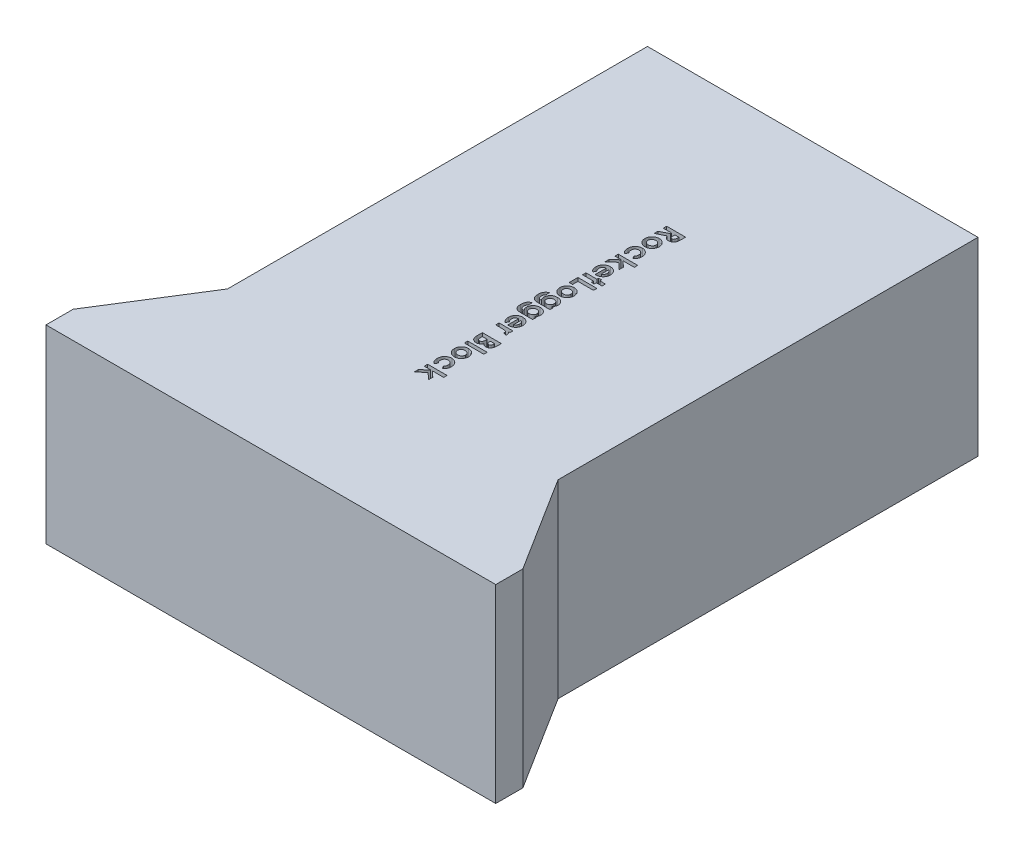
from build123d import *

# Parameters (mm, degrees)
BOSS_EXTRUDE1_DEPTH = 35
SKETCH2_W           = 3.58974359
SKETCH2_H           = 0.628205129
CUT_EXTRUDE1_DEPTH  = 5


with BuildPart() as part:
    # Sketch1 → Boss-Extrude1 (new body)
    with BuildSketch(Plane(origin=(0, 0, 0), x_dir=(1, 0, 0), z_dir=(0, 1, 0))):
        Polygon((-41.5, 0), (41.5, 0), (41.5, 5), (30.5, 22.5), (30.5, 100), (-30.5, 100), (-30.5, 22.5), (-41.5, 5), align=None)
    extrude(amount=BOSS_EXTRUDE1_DEPTH)

    # Sketch2 → Cut-Extrude1 (cut)
    # profile 1 of 17: a face of its own
    with BuildSketch(Plane(origin=(0, 35, 0), x_dir=(1, 0, 0), z_dir=(0, 1, 0))):
        with BuildLine():
            Line((3.5, 73.041666667), (3.5, 72.309695513))
            add(Edge.make_bspline(
                [(3.5, 72.309695513), (3.499828795, 72.261312365), (3.49949952, 72.168257943), (3.49428145, 72.034079788), (3.487053229, 71.910814317), (3.475887663, 71.798067928), (3.461449259, 71.696286705), (3.44393254, 71.605255076), (3.424143413, 71.52492018), (3.39988877, 71.454197037), (3.371956861, 71.390548982), (3.340429771, 71.331386173), (3.304116196, 71.275665734), (3.264487542, 71.222364929), (3.220124454, 71.17243515), (3.171386442, 71.12601474), (3.118624808, 71.082506812), (3.062156822, 71.041853789), (3.002061312, 71.005677243), (2.939191587, 70.973626607), (2.873377757, 70.947294), (2.804996593, 70.925368199), (2.733965865, 70.908486668), (2.660331689, 70.897024731), (2.584062765, 70.888549679), (2.532243077, 70.888066823), (2.505809295, 70.887820513)],
                knots=[0, 0, 0, 0, 1.749037589, 3.363891962, 4.853828513, 6.212420965, 7.458679178, 8.568887289, 9.562757098, 10.447168552, 11.268163578, 12.073310924, 12.867792413, 13.67045336, 14.472446998, 15.279188696, 16.101356728, 16.943088626, 17.792208908, 18.634830833, 19.491484118, 20.351879174, 21.228996054, 22.12769993, 23.044919519, 24, 24, 24, 24], degree=3))
            add(Edge.make_bspline(
                [(2.505809295, 70.887820513), (2.478219036, 70.888464475), (2.424119568, 70.889727167), (2.344651861, 70.896528716), (2.268622717, 70.90895981), (2.196254741, 70.927788511), (2.126647229, 70.949429656), (2.061084482, 70.978206829), (1.998612986, 71.010684712), (1.940116424, 71.049257745), (1.884295469, 71.091589765), (1.833288831, 71.140821013), (1.784355094, 71.193762061), (1.740559303, 71.253388919), (1.698940145, 71.317073178), (1.661222103, 71.386080179), (1.626457035, 71.459959557), (1.607069631, 71.511900418), (1.597155449, 71.538461538)],
                knots=[0, 0, 0, 0, 1.099860209, 2.156625411, 3.176576793, 4.16617041, 5.135385252, 6.078461593, 7.016046972, 7.938469504, 8.868247731, 9.803980173, 10.76021508, 11.73834243, 12.748633912, 13.790971185, 14.870363756, 16, 16, 16, 16], degree=3))
            Line((1.597155449, 71.538461538), (0, 70.730769231))
            Line((0, 70.730769231), (0, 71.429086538))
            Line((0, 71.429086538), (1.525641026, 72.200320513))
            Line((1.525641026, 72.200320513), (1.525641026, 72.413461538))
            Line((1.525641026, 72.413461538), (0, 72.413461538))
            Line((0, 72.413461538), (0, 73.041666667))
            Line((0, 73.041666667), (3.5, 73.041666667))
        make_face()
        with BuildLine():
            Line((2.153846154, 72.413461538), (2.153846154, 72.168770032))
            add(Edge.make_bspline(
                [(2.153846154, 72.168770032), (2.154183078, 72.138854457), (2.154828216, 72.081572558), (2.15782074, 71.999193739), (2.165030877, 71.924373861), (2.174141568, 71.856792771), (2.184658195, 71.796106707), (2.199739292, 71.742868763), (2.215869631, 71.696221175), (2.236011539, 71.656833708), (2.25851446, 71.623044634), (2.285206251, 71.594722488), (2.314445692, 71.569771696), (2.348073129, 71.550200079), (2.384710851, 71.534387474), (2.425048162, 71.524581007), (2.468354708, 71.516800504), (2.498523537, 71.516290853), (2.514222756, 71.516025641)],
                knots=[0, 0, 0, 0, 1.688935225, 3.233948049, 4.651771667, 5.929878493, 7.083962697, 8.124219224, 9.050753627, 9.864999381, 10.615157594, 11.334035464, 12.05533055, 12.777108108, 13.522027315, 14.29964284, 15.115170198, 16, 16, 16, 16], degree=3))
            add(Edge.make_bspline(
                [(2.514222756, 71.516025641), (2.53277191, 71.51673817), (2.569208284, 71.518137802), (2.621663167, 71.532027264), (2.670216539, 71.554134562), (2.714635437, 71.584443887), (2.75361627, 71.622591035), (2.787698432, 71.666293915), (2.815276822, 71.716197241), (2.832939391, 71.762732906), (2.843795948, 71.805364976), (2.8515027, 71.843714002), (2.857478213, 71.888243058), (2.86326295, 71.938703678), (2.867244729, 71.995312865), (2.870062043, 72.057966067), (2.871231041, 72.126698696), (2.871601517, 72.174612625), (2.871794872, 72.199619391)],
                knots=[0, 0, 0, 0, 1.020213939, 2.004021227, 2.966357326, 3.948562114, 4.950324333, 5.960000531, 6.991850424, 8.080015304, 8.69218159, 9.414443227, 10.233931419, 11.166782034, 12.212677862, 13.359889063, 14.622099264, 16, 16, 16, 16], degree=3))
            Line((2.871794872, 72.199619391), (2.871794872, 72.413461538))
            Line((2.871794872, 72.413461538), (2.153846154, 72.413461538))
        make_face(mode=Mode.SUBTRACT)
    # profile 2 of 17: a face of its own
    with BuildSketch(Plane(origin=(0, 35, 0), x_dir=(1, 0, 0), z_dir=(0, 1, 0))):
        with BuildLine():
            add(Edge.make_bspline(
                [(2.602564103, 69.0859375), (2.602036039, 69.056237031), (2.600990234, 68.997416646), (2.592270108, 68.909813542), (2.578080404, 68.823731985), (2.559528301, 68.738505804), (2.534007893, 68.654978813), (2.502911323, 68.572974412), (2.467417172, 68.491808115), (2.425149036, 68.413310801), (2.379254227, 68.336964729), (2.328950548, 68.264560266), (2.27355537, 68.197347467), (2.215913225, 68.132767871), (2.152057288, 68.074674207), (2.086496875, 68.018221644), (2.015265956, 67.968310954), (1.941218623, 67.921923148), (1.864350594, 67.880782163), (1.785518705, 67.844720793), (1.705074857, 67.814736589), (1.6230636, 67.790151485), (1.539846867, 67.770082985), (1.45465435, 67.757350928), (1.368315589, 67.748319024), (1.310186874, 67.747304935), (1.280949519, 67.746794872)],
                knots=[0, 0, 0, 0, 1.022204334, 2.024427765, 3.026941746, 4.024310199, 5.024497409, 6.030105378, 7.042160749, 8.071431822, 9.096544462, 10.107544126, 11.102638816, 12.093496961, 13.083897781, 14.071714019, 15.069569032, 16.074114518, 17.078305592, 18.068346939, 19.056064894, 20.030822231, 21.014304768, 21.999661014, 22.993877291, 24, 24, 24, 24], degree=3))
            add(Edge.make_bspline(
                [(1.280949519, 67.746794872), (1.251483609, 67.747332774), (1.192898699, 67.748402245), (1.105749868, 67.757028251), (1.020149054, 67.77129859), (0.935591969, 67.789776379), (0.8531606, 67.81547102), (0.771639876, 67.845492465), (0.692140957, 67.882344969), (0.613796583, 67.923088128), (0.538912191, 67.969700294), (0.46725794, 68.019680307), (0.400713659, 68.075072116), (0.337215623, 68.13282704), (0.278911053, 68.195684526), (0.224853238, 68.262641251), (0.174381296, 68.333117556), (0.128679395, 68.407620239), (0.088522765, 68.485195047), (0.052318285, 68.564533694), (0.022175471, 68.646100108), (-0.002405164, 68.729725483), (-0.021437335, 68.815460536), (-0.034366115, 68.903115986), (-0.043357932, 68.992503054), (-0.044363925, 69.052728541), (-0.044871795, 69.083133013)],
                knots=[0, 0, 0, 0, 1.012026251, 2.012137606, 3.004615893, 3.992048833, 4.982446996, 5.968083444, 6.973977695, 7.990229942, 8.999482246, 10.001782172, 10.988562221, 11.971415814, 12.948383116, 13.930088534, 14.925840678, 15.924049238, 16.929462851, 17.924729459, 18.917889337, 19.913673841, 20.916777188, 21.931792057, 22.95587778, 24, 24, 24, 24], degree=3))
            add(Edge.make_bspline(
                [(-0.044871795, 69.083133013), (-0.043567155, 69.127590731), (-0.040995689, 69.21521757), (-0.023374124, 69.344268062), (0.006935713, 69.468255086), (0.049261457, 69.587323451), (0.103143679, 69.701660302), (0.170917155, 69.809831607), (0.248524894, 69.914376406), (0.33877347, 70.01134543), (0.436877979, 70.100695619), (0.541262776, 70.179620793), (0.651372719, 70.245828749), (0.76637387, 70.300350838), (0.886758245, 70.342379889), (1.012109062, 70.372745103), (1.142794033, 70.39038327), (1.231584601, 70.392933661), (1.276742788, 70.394230769)],
                knots=[0, 0, 0, 0, 1.030065369, 2.030274526, 3.011405238, 3.982561859, 4.953899644, 5.933774183, 6.935609257, 7.966528366, 8.997788773, 10.007205882, 10.993508831, 11.969740339, 12.951110141, 13.942765373, 14.95370657, 16, 16, 16, 16], degree=3))
            add(Edge.make_bspline(
                [(1.276742788, 70.394230769), (1.324961886, 70.392888497), (1.419735557, 70.390250287), (1.558581145, 70.369301742), (1.691519215, 70.335849176), (1.818177898, 70.287830124), (1.938790798, 70.226490009), (2.053103529, 70.15160763), (2.161141984, 70.062812913), (2.226487346, 69.994813941), (2.259715545, 69.960236378)],
                knots=[0, 0, 0, 0, 1.043912699, 2.05178951, 3.033892, 4.007821512, 4.978932272, 5.95884105, 6.962068106, 8, 8, 8, 8], degree=3))
            add(Edge.make_bspline(
                [(2.259715545, 69.960236378), (2.287257984, 69.928508008), (2.341593515, 69.865914501), (2.410509228, 69.764220654), (2.470031379, 69.66009763), (2.518969657, 69.55229747), (2.55586833, 69.440519654), (2.582727262, 69.325336981), (2.599224805, 69.206773401), (2.601445347, 69.126420825), (2.602564103, 69.0859375)],
                knots=[0, 0, 0, 0, 1.048115528, 2.067714963, 3.060638214, 4.039924844, 5.017819947, 5.994373833, 6.98952318, 8, 8, 8, 8], degree=3))
        make_face()
        with BuildLine():
            add(Edge.make_bspline(
                [(2.019230769, 69.071915064), (2.018421649, 69.096237092), (2.016828888, 69.144115265), (2.00829896, 69.214599219), (1.990757294, 69.281240716), (1.968702569, 69.345272389), (1.938552525, 69.405386226), (1.90394775, 69.46383145), (1.860304777, 69.517337554), (1.812547901, 69.568543294), (1.759135283, 69.614720611), (1.702008348, 69.655413299), (1.640727081, 69.689386355), (1.576220965, 69.717495268), (1.507848073, 69.739331894), (1.435708778, 69.754437253), (1.360245434, 69.764851474), (1.308563282, 69.765630529), (1.282351763, 69.766025641)],
                knots=[0, 0, 0, 0, 1.03091935, 2.029375836, 2.999546758, 3.945310493, 4.892938212, 5.843870658, 6.816514129, 7.811084694, 8.807723078, 9.802195069, 10.777355085, 11.770643415, 12.778919339, 13.812070992, 14.890353012, 16, 16, 16, 16], degree=3))
            add(Edge.make_bspline(
                [(1.282351763, 69.766025641), (1.255214927, 69.765565623), (1.202181194, 69.764666607), (1.124745112, 69.755356397), (1.051257648, 69.74000506), (0.98183759, 69.718190457), (0.915967671, 69.690772909), (0.85408665, 69.657069208), (0.796184898, 69.6169315), (0.743440851, 69.570513229), (0.69480635, 69.520670495), (0.653639561, 69.465963407), (0.617158715, 69.409267839), (0.588459183, 69.348324513), (0.566072772, 69.284386025), (0.549633064, 69.217282536), (0.540766739, 69.14670487), (0.539240505, 69.098580403), (0.538461538, 69.074018429)],
                knots=[0, 0, 0, 0, 1.141867413, 2.231560573, 3.277337037, 4.297914881, 5.290025546, 6.276167544, 7.258622282, 8.248877712, 9.22995232, 10.184273261, 11.125934698, 12.063217848, 13.012199532, 13.973794674, 14.965856561, 16, 16, 16, 16], degree=3))
            add(Edge.make_bspline(
                [(0.538461538, 69.074018429), (0.539152861, 69.049444446), (0.540508254, 69.001265172), (0.550651819, 68.93060075), (0.566631685, 68.86316875), (0.589127728, 68.798632425), (0.618925107, 68.737482813), (0.65469473, 68.679133319), (0.696995143, 68.623905589), (0.746235863, 68.573325117), (0.799391374, 68.526338434), (0.857772519, 68.486142965), (0.919429055, 68.451658888), (0.985006485, 68.423555625), (1.054055229, 68.401686115), (1.126897802, 68.386592311), (1.203290349, 68.376143286), (1.255672488, 68.375385802), (1.282351763, 68.375)],
                knots=[0, 0, 0, 0, 1.031329209, 2.022003956, 2.990520627, 3.936919834, 4.884741893, 5.840502849, 6.805983488, 7.79826013, 8.799661902, 9.779443072, 10.767637054, 11.760883284, 12.769325295, 13.802659215, 14.880850239, 16, 16, 16, 16], degree=3))
            add(Edge.make_bspline(
                [(1.282351763, 68.375), (1.309021636, 68.37546591), (1.361356579, 68.376380176), (1.437853531, 68.385690493), (1.510456777, 68.400893157), (1.578861019, 68.422981955), (1.643829603, 68.450262225), (1.705092288, 68.483894128), (1.761991192, 68.524408727), (1.815257397, 68.56948533), (1.862919161, 68.62027289), (1.904981266, 68.674599887), (1.940369092, 68.732736261), (1.969299368, 68.794076624), (1.991598563, 68.858764428), (2.008140094, 68.926774942), (2.016877946, 68.998303509), (2.018438298, 69.047121436), (2.019230769, 69.071915064)],
                knots=[0, 0, 0, 0, 1.123798992, 2.205258179, 3.242884828, 4.246127484, 5.230570643, 6.209477068, 7.185255276, 8.170486857, 9.146165591, 10.115657081, 11.061842515, 12.009360533, 12.968990825, 13.941530959, 14.954545611, 16, 16, 16, 16], degree=3))
        make_face(mode=Mode.SUBTRACT)
    # profile 3 of 17: a face of its own
    with BuildSketch(Plane(origin=(0, 35, 0), x_dir=(1, 0, 0), z_dir=(0, 1, 0))):
        with BuildLine():
            Line((2.036057692, 64.740384615), (1.75, 65.260616987))
            add(Edge.make_bspline(
                [(1.75, 65.260616987), (1.773875664, 65.284464178), (1.819770694, 65.330304473), (1.877922237, 65.403786419), (1.925755649, 65.475874332), (1.961840058, 65.549467028), (1.988064538, 65.625851639), (2.005975749, 65.707254783), (2.017591254, 65.794536442), (2.018672996, 65.85489519), (2.019230769, 65.886017628)],
                knots=[0, 0, 0, 0, 1.150712254, 2.211958248, 3.191962159, 4.097966493, 5.000946703, 5.941300148, 6.938484308, 8, 8, 8, 8], degree=3))
            add(Edge.make_bspline(
                [(2.019230769, 65.886017628), (2.018541361, 65.914560188), (2.017192247, 65.970415585), (2.007115291, 66.052029184), (1.991288235, 66.129594546), (1.968133197, 66.202972437), (1.937544132, 66.272032165), (1.901346575, 66.337344824), (1.858126697, 66.398275746), (1.808498859, 66.453963655), (1.75385971, 66.504231782), (1.695584708, 66.549073515), (1.63280936, 66.585809485), (1.567009112, 66.617570008), (1.496948089, 66.640920733), (1.423262022, 66.658004691), (1.345947647, 66.667742388), (1.29312872, 66.669153209), (1.266225962, 66.669871795)],
                knots=[0, 0, 0, 0, 1.121765476, 2.195200973, 3.227634963, 4.230038321, 5.213228299, 6.192116585, 7.160777141, 8.14345191, 9.118668839, 10.075979138, 11.027630062, 11.972829041, 12.943187208, 13.923755399, 14.94248691, 16, 16, 16, 16], degree=3))
            add(Edge.make_bspline(
                [(1.266225962, 66.669871795), (1.240025059, 66.669112907), (1.188865942, 66.667631125), (1.113704674, 66.658518178), (1.042140348, 66.642724963), (0.974616463, 66.618951156), (0.910164334, 66.590728126), (0.850291431, 66.554065689), (0.793288813, 66.512324705), (0.741051243, 66.463746045), (0.69298123, 66.410704873), (0.651910421, 66.352263186), (0.616406183, 66.290497606), (0.588305601, 66.224208612), (0.56583871, 66.154079668), (0.54968001, 66.079679349), (0.540737744, 66.00121945), (0.539232002, 65.947738131), (0.538461538, 65.920372596)],
                knots=[0, 0, 0, 0, 1.070775258, 2.090764541, 3.089424503, 4.058978413, 5.012260063, 5.959012309, 6.921768211, 7.895125137, 8.869137869, 9.841744761, 10.808424796, 11.775340716, 12.7781482, 13.814110449, 14.881515328, 16, 16, 16, 16], degree=3))
            add(Edge.make_bspline(
                [(0.538461538, 65.920372596), (0.539232552, 65.886678764), (0.540737458, 65.820913299), (0.553501588, 65.7253094), (0.574608971, 65.635347438), (0.603823265, 65.551017875), (0.642021499, 65.472438688), (0.688677792, 65.399811782), (0.743447968, 65.332390552), (0.78614803, 65.293074206), (0.807692308, 65.273237179)],
                knots=[0, 0, 0, 0, 1.116373375, 2.178998604, 3.189797796, 4.174590301, 5.13072713, 6.078291395, 7.030403691, 8, 8, 8, 8], degree=3))
            Line((0.807692308, 65.273237179), (0.47255609, 64.78525641))
            add(Edge.make_bspline(
                [(0.47255609, 64.78525641), (0.431201382, 64.819080893), (0.349591011, 64.885830939), (0.244398221, 65.002291258), (0.154014242, 65.127637737), (0.081870894, 65.264391365), (0.024490084, 65.410560557), (-0.016072452, 65.567287485), (-0.039949889, 65.734307056), (-0.043204935, 65.849013158), (-0.044871795, 65.907752404)],
                knots=[0, 0, 0, 0, 0.997876357, 1.969233105, 2.924898516, 3.881013542, 4.852507933, 5.855329832, 6.901747111, 8, 8, 8, 8], degree=3))
            add(Edge.make_bspline(
                [(-0.044871795, 65.907752404), (-0.043649554, 65.960621319), (-0.041262383, 66.06388014), (-0.022983096, 66.214378128), (0.007810762, 66.355926235), (0.05056079, 66.488829743), (0.105995361, 66.612917158), (0.174453398, 66.727808102), (0.254996858, 66.833794175), (0.346868396, 66.929924968), (0.446503917, 67.01643591), (0.551833084, 67.091560311), (0.661209986, 67.155216175), (0.774619085, 67.207280165), (0.892343556, 67.248540876), (1.014646554, 67.276692749), (1.140862661, 67.295178949), (1.226429524, 67.297103157), (1.269731571, 67.298076923)],
                knots=[0, 0, 0, 0, 1.183466993, 2.311441534, 3.388064541, 4.422247864, 5.431673423, 6.424154247, 7.409964484, 8.40557137, 9.395939635, 10.360028593, 11.297860889, 12.225005956, 13.15002244, 14.08539929, 15.031095383, 16, 16, 16, 16], degree=3))
            add(Edge.make_bspline(
                [(1.269731571, 67.298076923), (1.299899243, 67.297549034), (1.359652125, 67.296503449), (1.448422922, 67.287801415), (1.535512174, 67.273721434), (1.621009296, 67.25457855), (1.704024318, 67.227836687), (1.785894207, 67.197415582), (1.865413218, 67.159858797), (1.943503693, 67.118107951), (2.018056467, 67.070484832), (2.089047189, 67.018536279), (2.156054888, 66.962337027), (2.218391486, 66.901179287), (2.276867486, 66.835540864), (2.331605908, 66.765778077), (2.38123404, 66.690815288), (2.427634317, 66.61268503), (2.468757429, 66.530887953), (2.50477027, 66.446413769), (2.534879582, 66.359464281), (2.5592756, 66.269920319), (2.579346316, 66.178287333), (2.592092169, 66.08377235), (2.601048567, 65.987151224), (2.602055878, 65.921796091), (2.602564103, 65.888822115)],
                knots=[0, 0, 0, 0, 1.002744927, 1.986129377, 2.961996146, 3.934516865, 4.895328879, 5.859245809, 6.836009102, 7.816350296, 8.8013601, 9.774160095, 10.739109777, 11.70609044, 12.674568171, 13.659914977, 14.651155989, 15.661188685, 16.67925772, 17.692304066, 18.712002368, 19.735511866, 20.776303546, 21.827827701, 22.904062265, 24, 24, 24, 24], degree=3))
            add(Edge.make_bspline(
                [(2.602564103, 65.888822115), (2.602222381, 65.858192844), (2.601548434, 65.797785445), (2.594323186, 65.708357819), (2.582415065, 65.621550424), (2.566135442, 65.537099875), (2.546211382, 65.454671715), (2.519977833, 65.375021579), (2.489715508, 65.29757666), (2.444472767, 65.198182854), (2.37628307, 65.081313074), (2.279312253, 64.9525973), (2.165516681, 64.837783948), (2.079440052, 64.773023622), (2.036057692, 64.740384615)],
                knots=[0, 0, 0, 0, 0.826697341, 1.630421964, 2.420057333, 3.190919537, 3.95141075, 4.707571635, 5.452703147, 6.195185746, 7.653864383, 9.094862744, 10.535819671, 12, 12, 12, 12], degree=3))
        make_face()
    # profile 4 of 17: a face of its own
    with BuildSketch(Plane(origin=(0, 35, 0), x_dir=(1, 0, 0), z_dir=(0, 1, 0))):
        Polygon((3.58974359, 64.112179487), (3.58974359, 63.483974359), (1.49619391, 63.483974359), (2.557692308, 62.506610577), (2.557692308, 61.73046875), (1.338441506, 62.852964744), (0, 61.569911859), (0, 62.360777244), (1.171574519, 63.483974359), (0, 63.483974359), (0, 64.112179487), align=None)
    # profile 5 of 17: a face of its own
    with BuildSketch(Plane(origin=(0, 35, 0), x_dir=(1, 0, 0), z_dir=(0, 1, 0))):
        with BuildLine():
            Line((1.121794872, 58.729667468), (1.121794872, 60.746794872))
            add(Edge.make_bspline(
                [(1.121794872, 60.746794872), (1.098356996, 60.742682112), (1.05229972, 60.734600214), (0.985397531, 60.717050086), (0.922350037, 60.694653491), (0.863072959, 60.667812581), (0.807252923, 60.636979895), (0.755151746, 60.601016122), (0.706815448, 60.560377428), (0.662454103, 60.515298777), (0.622705377, 60.466531547), (0.58788298, 60.414312241), (0.559330745, 60.358586973), (0.535264173, 60.299994611), (0.51620101, 60.238097336), (0.503053509, 60.17280405), (0.495287233, 60.104287837), (0.494163929, 60.057612499), (0.493589744, 60.033754006)],
                knots=[0, 0, 0, 0, 1.091296461, 2.144483647, 3.168565212, 4.157007626, 5.126487748, 6.090021542, 7.05641414, 8.019231907, 8.98705074, 9.938580405, 10.892824166, 11.854447369, 12.841318655, 13.858982407, 14.905600794, 16, 16, 16, 16], degree=3))
            add(Edge.make_bspline(
                [(0.493589744, 60.033754006), (0.49435006, 60.004955186), (0.495847348, 59.948241828), (0.509126063, 59.865156336), (0.52918298, 59.784800562), (0.559009298, 59.707934956), (0.596137822, 59.633669149), (0.642395393, 59.563225785), (0.696430216, 59.495385545), (0.738080236, 59.453995004), (0.759314904, 59.432892628)],
                knots=[0, 0, 0, 0, 1.021034703, 2.010718019, 2.977989445, 3.954245119, 4.929443971, 5.918328161, 6.938689359, 8, 8, 8, 8], degree=3))
            Line((0.759314904, 59.432892628), (0.509014423, 58.907051282))
            add(Edge.make_bspline(
                [(0.509014423, 58.907051282), (0.486155389, 58.923868287), (0.440971692, 58.957109169), (0.377231715, 59.010661447), (0.317294152, 59.06586585), (0.262424599, 59.124177386), (0.212790148, 59.185450529), (0.166964077, 59.248391834), (0.126173399, 59.314104122), (0.089504684, 59.382078936), (0.057830724, 59.453405228), (0.030862734, 59.527846928), (0.006471686, 59.605051694), (-0.012109983, 59.686004691), (-0.026819932, 59.770028997), (-0.037265725, 59.857326406), (-0.043717646, 59.94788519), (-0.044482509, 60.009437476), (-0.044871795, 60.040765224)],
                knots=[0, 0, 0, 0, 1.033338888, 2.04252164, 3.030262006, 3.999752838, 4.955583682, 5.900551376, 6.833481756, 7.770287093, 8.71145193, 9.672837889, 10.652846169, 11.658324827, 12.695268294, 13.758430956, 14.85912751, 16, 16, 16, 16], degree=3))
            add(Edge.make_bspline(
                [(-0.044871795, 60.040765224), (-0.043889198, 60.088962449), (-0.04196484, 60.183353936), (-0.024104041, 60.321418552), (0.005511096, 60.452541631), (0.045768304, 60.577093478), (0.098920509, 60.69453548), (0.163929779, 60.804926563), (0.239551053, 60.909366676), (0.327366491, 61.004675887), (0.422963104, 61.091472618), (0.525573502, 61.167828709), (0.634812361, 61.231338261), (0.748902717, 61.285050239), (0.869967292, 61.324426218), (0.996285236, 61.354147608), (1.128761591, 61.372046031), (1.218962485, 61.374004332), (1.264823718, 61.375)],
                knots=[0, 0, 0, 0, 1.103528868, 2.161197684, 3.181904866, 4.17893931, 5.15400521, 6.128071465, 7.108807125, 8.101535823, 9.090664498, 10.062772592, 11.024896103, 11.980490186, 12.945349712, 13.934753549, 14.949957771, 16, 16, 16, 16], degree=3))
            add(Edge.make_bspline(
                [(1.264823718, 61.375), (1.311853206, 61.374002133), (1.404381613, 61.372038874), (1.539876186, 61.354217608), (1.669169542, 61.324634829), (1.792377939, 61.283719826), (1.910221059, 61.232302326), (2.020708223, 61.166706978), (2.125571291, 61.090883873), (2.22337218, 61.004306075), (2.311684044, 60.9086145), (2.390415239, 60.806928162), (2.455768557, 60.698226667), (2.509134712, 60.58390558), (2.551981482, 60.464142511), (2.580665402, 60.337704527), (2.59989025, 60.205652526), (2.601663059, 60.115388544), (2.602564103, 60.069511218)],
                knots=[0, 0, 0, 0, 1.079354094, 2.123580709, 3.131027717, 4.120248802, 5.100347326, 6.076737579, 7.064152558, 8.067633759, 9.069995403, 10.049814825, 11.015114092, 11.975254693, 12.94256508, 13.929104949, 14.947452504, 16, 16, 16, 16], degree=3))
            add(Edge.make_bspline(
                [(2.602564103, 60.069511218), (2.601566999, 60.021082764), (2.599609288, 59.925998485), (2.581883105, 59.78697698), (2.552124837, 59.654966388), (2.512016071, 59.529300264), (2.457886463, 59.411449345), (2.394258341, 59.299355948), (2.317031322, 59.195566325), (2.229644572, 59.098843031), (2.132653234, 59.011610178), (2.027566894, 58.93511985), (1.914481574, 58.871164405), (1.79426915, 58.818339341), (1.666335977, 58.777717994), (1.531183285, 58.748307342), (1.388233557, 58.730449131), (1.290350183, 58.728540391), (1.240284455, 58.727564103)],
                knots=[0, 0, 0, 0, 1.079855552, 2.120185087, 3.119263157, 4.095157605, 5.056350796, 6.006812003, 6.964961307, 7.935564877, 8.91003822, 9.869321262, 10.82883089, 11.80218819, 12.792963453, 13.817487929, 14.883681165, 16, 16, 16, 16], degree=3))
            Line((1.240284455, 58.727564103), (1.121794872, 58.729667468))
        make_face()
        with BuildLine():
            add(Edge.make_bspline(
                [(1.615384615, 59.355769231), (1.647420267, 59.367556434), (1.711230452, 59.391034763), (1.798280837, 59.445294839), (1.875018518, 59.515004792), (1.941986022, 59.597322625), (1.996661692, 59.691138404), (2.036187895, 59.793803944), (2.059902703, 59.903903127), (2.062682887, 59.979649888), (2.064102564, 60.018329327)],
                knots=[0, 0, 0, 0, 0.954352776, 1.900926752, 2.851296618, 3.847186113, 4.86225778, 5.87988081, 6.91737917, 8, 8, 8, 8], degree=3))
            add(Edge.make_bspline(
                [(2.064102564, 60.018329327), (2.062738487, 60.060573155), (2.060071999, 60.143151044), (2.031712926, 60.262264025), (1.989387857, 60.374620321), (1.945749811, 60.440859224), (1.923878205, 60.474058494)],
                knots=[0, 0, 0, 0, 1.044195649, 2.041185066, 3.018232172, 4, 4, 4, 4], degree=3))
            add(Edge.make_bspline(
                [(1.923878205, 60.474058494), (1.907220311, 60.494772358), (1.871706531, 60.538933258), (1.800859913, 60.596285147), (1.715080563, 60.652777234), (1.649925086, 60.6848961), (1.615384615, 60.701923077)],
                knots=[0, 0, 0, 0, 0.82159062, 1.751589201, 2.808063854, 4, 4, 4, 4], degree=3))
            Line((1.615384615, 60.701923077), (1.615384615, 59.355769231))
        make_face(mode=Mode.SUBTRACT)
    # profile 6 of 17: a face of its own
    with BuildSketch(Plane(origin=(0, 35, 0), x_dir=(1, 0, 0), z_dir=(0, 1, 0))):
        Polygon((3.58974359, 58.144230769), (3.58974359, 57.516025641), (2.557692308, 57.516025641), (2.557692308, 57.112179487), (2.019230769, 57.112179487), (2.019230769, 57.516025641), (0, 57.516025641), (0, 58.144230769), (2.019230769, 58.144230769), (2.019230769, 58.458333333), (2.557692308, 58.458333333), (2.557692308, 58.144230769), align=None)
    # profile 7 of 17: a face of its own
    with BuildSketch(Plane(origin=(0, 35, 0), x_dir=(1, 0, 0), z_dir=(0, 1, 0))):
        Polygon((3.5, 56.663461538), (3.5, 56.03525641), (0.628205128, 56.03525641), (0.628205128, 55.048076923), (0, 55.048076923), (0, 56.663461538), align=None)
    # profile 8 of 17: a face of its own
    with BuildSketch(Plane(origin=(0, 35, 0), x_dir=(1, 0, 0), z_dir=(0, 1, 0))):
        with BuildLine():
            add(Edge.make_bspline(
                [(2.602564103, 53.380809295), (2.602036039, 53.351108826), (2.600990234, 53.29228844), (2.592270108, 53.204685337), (2.578080404, 53.11860378), (2.559528301, 53.033377599), (2.534007893, 52.949850607), (2.502911323, 52.867846207), (2.467417172, 52.78667991), (2.425149036, 52.708182596), (2.379254227, 52.631836524), (2.328950548, 52.559432061), (2.27355537, 52.492219262), (2.215913225, 52.427639666), (2.152057288, 52.369546002), (2.086496875, 52.313093439), (2.015265956, 52.263182748), (1.941218623, 52.216794943), (1.864350594, 52.175653957), (1.785518705, 52.139592587), (1.705074857, 52.109608383), (1.6230636, 52.08502328), (1.539846867, 52.06495478), (1.45465435, 52.052222723), (1.368315589, 52.043190819), (1.310186874, 52.042176729), (1.280949519, 52.041666667)],
                knots=[0, 0, 0, 0, 1.022204334, 2.024427765, 3.026941746, 4.024310199, 5.024497409, 6.030105378, 7.042160749, 8.071431822, 9.096544462, 10.107544126, 11.102638816, 12.093496961, 13.083897781, 14.071714019, 15.069569032, 16.074114518, 17.078305592, 18.068346939, 19.056064894, 20.030822231, 21.014304768, 21.999661014, 22.993877291, 24, 24, 24, 24], degree=3))
            add(Edge.make_bspline(
                [(1.280949519, 52.041666667), (1.251483609, 52.042204569), (1.192898699, 52.04327404), (1.105749868, 52.051900046), (1.020149054, 52.066170385), (0.935591969, 52.084648174), (0.8531606, 52.110342815), (0.771639876, 52.140364259), (0.692140957, 52.177216764), (0.613796583, 52.217959923), (0.538912191, 52.264572088), (0.46725794, 52.314552102), (0.400713659, 52.369943911), (0.337215623, 52.427698835), (0.278911053, 52.490556321), (0.224853238, 52.557513046), (0.174381296, 52.627989351), (0.128679395, 52.702492034), (0.088522765, 52.780066842), (0.052318285, 52.859405488), (0.022175471, 52.940971903), (-0.002405164, 53.024597278), (-0.021437335, 53.110332331), (-0.034366115, 53.197987781), (-0.043357932, 53.287374849), (-0.044363925, 53.347600336), (-0.044871795, 53.378004808)],
                knots=[0, 0, 0, 0, 1.012026251, 2.012137606, 3.004615893, 3.992048833, 4.982446996, 5.968083444, 6.973977695, 7.990229942, 8.999482246, 10.001782172, 10.988562221, 11.971415814, 12.948383116, 13.930088534, 14.925840678, 15.924049238, 16.929462851, 17.924729459, 18.917889337, 19.913673841, 20.916777188, 21.931792057, 22.95587778, 24, 24, 24, 24], degree=3))
            add(Edge.make_bspline(
                [(-0.044871795, 53.378004808), (-0.043567155, 53.422462526), (-0.040995689, 53.510089365), (-0.023374124, 53.639139857), (0.006935713, 53.763126881), (0.049261457, 53.882195246), (0.103143679, 53.996532097), (0.170917155, 54.104703402), (0.248524894, 54.209248201), (0.33877347, 54.306217225), (0.436877979, 54.395567414), (0.541262776, 54.474492588), (0.651372719, 54.540700544), (0.76637387, 54.595222633), (0.886758245, 54.637251684), (1.012109062, 54.667616898), (1.142794033, 54.685255065), (1.231584601, 54.687805456), (1.276742788, 54.689102564)],
                knots=[0, 0, 0, 0, 1.030065369, 2.030274526, 3.011405238, 3.982561859, 4.953899644, 5.933774183, 6.935609257, 7.966528366, 8.997788773, 10.007205882, 10.993508831, 11.969740339, 12.951110141, 13.942765373, 14.95370657, 16, 16, 16, 16], degree=3))
            add(Edge.make_bspline(
                [(1.276742788, 54.689102564), (1.324961886, 54.687760292), (1.419735557, 54.685122082), (1.558581145, 54.664173537), (1.691519215, 54.630720971), (1.818177898, 54.582701919), (1.938790798, 54.521361804), (2.053103529, 54.446479425), (2.161141984, 54.357684708), (2.226487346, 54.289685736), (2.259715545, 54.255108173)],
                knots=[0, 0, 0, 0, 1.043912699, 2.05178951, 3.033892, 4.007821512, 4.978932272, 5.95884105, 6.962068106, 8, 8, 8, 8], degree=3))
            add(Edge.make_bspline(
                [(2.259715545, 54.255108173), (2.287257984, 54.223379803), (2.341593515, 54.160786296), (2.410509228, 54.059092449), (2.470031379, 53.954969425), (2.518969657, 53.847169265), (2.55586833, 53.735391449), (2.582727262, 53.620208776), (2.599224805, 53.501645196), (2.601445347, 53.42129262), (2.602564103, 53.380809295)],
                knots=[0, 0, 0, 0, 1.048115528, 2.067714963, 3.060638214, 4.039924844, 5.017819947, 5.994373833, 6.98952318, 8, 8, 8, 8], degree=3))
        make_face()
        with BuildLine():
            add(Edge.make_bspline(
                [(2.019230769, 53.366786859), (2.018421649, 53.391108887), (2.016828888, 53.43898706), (2.00829896, 53.509471014), (1.990757294, 53.576112511), (1.968702569, 53.640144184), (1.938552525, 53.700258021), (1.90394775, 53.758703245), (1.860304777, 53.812209349), (1.812547901, 53.863415089), (1.759135283, 53.909592406), (1.702008348, 53.950285094), (1.640727081, 53.98425815), (1.576220965, 54.012367062), (1.507848073, 54.034203688), (1.435708778, 54.049309048), (1.360245434, 54.059723269), (1.308563282, 54.060502324), (1.282351763, 54.060897436)],
                knots=[0, 0, 0, 0, 1.03091935, 2.029375836, 2.999546758, 3.945310493, 4.892938212, 5.843870658, 6.816514129, 7.811084694, 8.807723078, 9.802195069, 10.777355085, 11.770643415, 12.778919339, 13.812070992, 14.890353012, 16, 16, 16, 16], degree=3))
            add(Edge.make_bspline(
                [(1.282351763, 54.060897436), (1.255214927, 54.060437418), (1.202181194, 54.059538401), (1.124745112, 54.050228192), (1.051257648, 54.034876855), (0.98183759, 54.013062252), (0.915967671, 53.985644703), (0.85408665, 53.951941003), (0.796184898, 53.911803295), (0.743440851, 53.865385024), (0.69480635, 53.81554229), (0.653639561, 53.760835202), (0.617158715, 53.704139634), (0.588459183, 53.643196308), (0.566072772, 53.57925782), (0.549633064, 53.51215433), (0.540766739, 53.441576664), (0.539240505, 53.393452198), (0.538461538, 53.368890224)],
                knots=[0, 0, 0, 0, 1.141867413, 2.231560573, 3.277337037, 4.297914881, 5.290025546, 6.276167544, 7.258622282, 8.248877712, 9.22995232, 10.184273261, 11.125934698, 12.063217848, 13.012199532, 13.973794674, 14.965856561, 16, 16, 16, 16], degree=3))
            add(Edge.make_bspline(
                [(0.538461538, 53.368890224), (0.539152861, 53.344316241), (0.540508254, 53.296136967), (0.550651819, 53.225472545), (0.566631685, 53.158040545), (0.589127728, 53.09350422), (0.618925107, 53.032354608), (0.65469473, 52.974005114), (0.696995143, 52.918777384), (0.746235863, 52.868196912), (0.799391374, 52.821210229), (0.857772519, 52.78101476), (0.919429055, 52.746530683), (0.985006485, 52.71842742), (1.054055229, 52.696557909), (1.126897802, 52.681464105), (1.203290349, 52.671015081), (1.255672488, 52.670257597), (1.282351763, 52.669871795)],
                knots=[0, 0, 0, 0, 1.031329209, 2.022003956, 2.990520627, 3.936919834, 4.884741893, 5.840502849, 6.805983488, 7.79826013, 8.799661902, 9.779443072, 10.767637054, 11.760883284, 12.769325295, 13.802659215, 14.880850239, 16, 16, 16, 16], degree=3))
            add(Edge.make_bspline(
                [(1.282351763, 52.669871795), (1.309021636, 52.670337705), (1.361356579, 52.671251971), (1.437853531, 52.680562288), (1.510456777, 52.695764952), (1.578861019, 52.71785375), (1.643829603, 52.745134019), (1.705092288, 52.778765923), (1.761991192, 52.819280522), (1.815257397, 52.864357125), (1.862919161, 52.915144685), (1.904981266, 52.969471682), (1.940369092, 53.027608056), (1.969299368, 53.088948419), (1.991598563, 53.153636223), (2.008140094, 53.221646737), (2.016877946, 53.293175304), (2.018438298, 53.341993231), (2.019230769, 53.366786859)],
                knots=[0, 0, 0, 0, 1.123798992, 2.205258179, 3.242884828, 4.246127484, 5.230570643, 6.209477068, 7.185255276, 8.170486857, 9.146165591, 10.115657081, 11.061842515, 12.009360533, 12.968990825, 13.941530959, 14.954545611, 16, 16, 16, 16], degree=3))
        make_face(mode=Mode.SUBTRACT)
    # profile 9 of 17: a face of its own
    with BuildSketch(Plane(origin=(0, 35, 0), x_dir=(1, 0, 0), z_dir=(0, 1, 0))):
        with BuildLine():
            Line((2.557692308, 49.618589744), (2.557692308, 48.945512821))
            Line((2.557692308, 48.945512821), (0.375801282, 48.945512821))
            add(Edge.make_bspline(
                [(0.375801282, 48.945512821), (0.323661035, 48.946321684), (0.222976172, 48.94788363), (0.077057798, 48.959798604), (-0.058216561, 48.979668358), (-0.183038485, 49.008260232), (-0.296949194, 49.045188013), (-0.400327385, 49.09035209), (-0.493727446, 49.142834184), (-0.548303344, 49.185986147), (-0.574919872, 49.20703125)],
                knots=[0, 0, 0, 0, 1.243822755, 2.401870584, 3.490053692, 4.503076575, 5.453444971, 6.342269266, 7.191528908, 8, 8, 8, 8], degree=3))
            add(Edge.make_bspline(
                [(-0.574919872, 49.20703125), (-0.608068927, 49.237252309), (-0.674199212, 49.297541424), (-0.757653291, 49.403834514), (-0.828979993, 49.520282509), (-0.887435644, 49.648073782), (-0.931960201, 49.787056118), (-0.964025818, 49.936872486), (-0.983997795, 50.097617865), (-0.986099069, 50.208640397), (-0.987179487, 50.26572516)],
                knots=[0, 0, 0, 0, 0.916003385, 1.827369254, 2.751972866, 3.703651841, 4.69362366, 5.730423306, 6.83304546, 8, 8, 8, 8], degree=3))
            add(Edge.make_bspline(
                [(-0.987179487, 50.26572516), (-0.986239679, 50.326066037), (-0.984432184, 50.44211708), (-0.966955613, 50.608667896), (-0.937856165, 50.76030856), (-0.897236638, 50.897846786), (-0.844751987, 51.022790055), (-0.781463204, 51.137195182), (-0.706878312, 51.241430083), (-0.621498116, 51.335360061), (-0.525702084, 51.418435196), (-0.419902755, 51.490307362), (-0.304094228, 51.550657162), (-0.22147647, 51.580557027), (-0.179487179, 51.595753205)],
                knots=[0, 0, 0, 0, 1.294310516, 2.489292395, 3.587744034, 4.60306188, 5.560411947, 6.489668278, 7.402490793, 8.304088801, 9.206940867, 10.116507331, 11.042741859, 12, 12, 12, 12], degree=3))
            Line((-0.179487179, 51.595753205), (-0.179487179, 50.897435897))
            add(Edge.make_bspline(
                [(-0.179487179, 50.897435897), (-0.197254604, 50.881299316), (-0.233015243, 50.848821088), (-0.278362284, 50.791361134), (-0.317414382, 50.727675785), (-0.348860121, 50.65711032), (-0.373124106, 50.580103048), (-0.391658313, 50.496907283), (-0.401915159, 50.406908475), (-0.40318937, 50.344743102), (-0.403846154, 50.312700321)],
                knots=[0, 0, 0, 0, 0.889034375, 1.789366662, 2.703738048, 3.654376023, 4.646823881, 5.694311852, 6.811546407, 8, 8, 8, 8], degree=3))
            add(Edge.make_bspline(
                [(-0.403846154, 50.312700321), (-0.403113039, 50.272201479), (-0.401717046, 50.195083841), (-0.385656432, 50.085716274), (-0.362378357, 49.98792515), (-0.326702317, 49.903131435), (-0.284047097, 49.830140452), (-0.234476609, 49.769251924), (-0.179881228, 49.718974821), (-0.128519287, 49.686088515), (-0.081925892, 49.666546214), (-0.041693134, 49.653239078), (0.004682411, 49.643133494), (0.056332774, 49.633934748), (0.113923379, 49.627058535), (0.177332221, 49.622502956), (0.246279935, 49.618552586), (0.294230952, 49.618577084), (0.319010417, 49.618589744)],
                knots=[0, 0, 0, 0, 1.656396326, 3.154099419, 4.516105643, 5.759778864, 6.904991222, 7.965818938, 8.961355255, 9.932836416, 10.442842043, 11.026725364, 11.664904991, 12.383683203, 13.173965839, 14.037570723, 14.985882864, 16, 16, 16, 16], degree=3))
            add(Edge.make_bspline(
                [(0.319010417, 49.618589744), (0.292020204, 49.646112411), (0.239351682, 49.699819961), (0.172117856, 49.786985503), (0.116843704, 49.876110579), (0.072354085, 49.967519658), (0.040104305, 50.063813315), (0.017069137, 50.165274471), (0.002822735, 50.272802775), (0.000954436, 50.346543631), (0, 50.384214744)],
                knots=[0, 0, 0, 0, 1.081942939, 2.111296224, 3.084006935, 4.023482554, 4.959650313, 5.929366524, 6.942200141, 8, 8, 8, 8], degree=3))
            add(Edge.make_bspline(
                [(0, 50.384214744), (0.000962318, 50.425882468), (0.002852652, 50.507732656), (0.021232372, 50.627950476), (0.049808377, 50.743301417), (0.089663941, 50.854036399), (0.142214015, 50.959069371), (0.205820987, 51.059416726), (0.281015253, 51.154764231), (0.367053212, 51.244133919), (0.461749861, 51.32544969), (0.563132686, 51.397892849), (0.671487134, 51.458121116), (0.785763333, 51.507262228), (0.905816537, 51.546357975), (1.032237839, 51.573278264), (1.164829936, 51.589725057), (1.255193299, 51.591859878), (1.301282051, 51.592948718)],
                knots=[0, 0, 0, 0, 1.007633875, 1.979350261, 2.935339252, 3.879902641, 4.82071731, 5.771456477, 6.750059904, 7.753957578, 8.768502614, 9.766441343, 10.763931315, 11.761934136, 12.772372964, 13.813920023, 14.885016084, 16, 16, 16, 16], degree=3))
            add(Edge.make_bspline(
                [(1.301282051, 51.592948718), (1.350418961, 51.591997793), (1.446450927, 51.590139329), (1.586717877, 51.571921078), (1.719932746, 51.543572598), (1.845816878, 51.503104399), (1.963832125, 51.449938266), (2.074352959, 51.385689122), (2.17864323, 51.310963044), (2.240512074, 51.251811112), (2.271634615, 51.222055288)],
                knots=[0, 0, 0, 0, 1.104124469, 2.157873671, 3.173961494, 4.162551312, 5.124378318, 6.07778831, 7.033049473, 8, 8, 8, 8], degree=3))
            add(Edge.make_bspline(
                [(2.271634615, 51.222055288), (2.298172078, 51.193817441), (2.350465474, 51.138173352), (2.41756658, 51.047084152), (2.475119282, 50.952745672), (2.521413942, 50.853863959), (2.558280474, 50.751138697), (2.58407154, 50.643961744), (2.599973716, 50.532866013), (2.601694196, 50.457418499), (2.602564103, 50.419270833)],
                knots=[0, 0, 0, 0, 1.042068658, 2.053448347, 3.038272799, 4.011764631, 4.986555969, 5.970496305, 6.973845226, 8, 8, 8, 8], degree=3))
            add(Edge.make_bspline(
                [(2.602564103, 50.419270833), (2.601556355, 50.383474511), (2.599559438, 50.312541829), (2.585543927, 50.207433854), (2.560523364, 50.105505027), (2.526889024, 50.005760734), (2.482116114, 49.90760421), (2.424425024, 49.810575161), (2.355089011, 49.712721487), (2.300952739, 49.650615357), (2.273036859, 49.618589744)],
                knots=[0, 0, 0, 0, 0.968095079, 1.918341733, 2.861180713, 3.802641504, 4.7615102, 5.772938058, 6.851594447, 8, 8, 8, 8], degree=3))
            Line((2.273036859, 49.618589744), (2.557692308, 49.618589744))
        make_face()
        with BuildLine():
            add(Edge.make_bspline(
                [(2.019230769, 50.269230769), (2.018439382, 50.293790649), (2.016881345, 50.342142723), (2.008102828, 50.413204782), (1.991533715, 50.480643863), (1.970015484, 50.545277867), (1.941083414, 50.606335693), (1.905732297, 50.663880408), (1.86499408, 50.718664381), (1.817132436, 50.768324719), (1.765846927, 50.814716074), (1.710140642, 50.854961868), (1.650870072, 50.888395459), (1.589056317, 50.917142744), (1.523157489, 50.937830379), (1.454428749, 50.953080831), (1.382465461, 50.963609904), (1.333338439, 50.964360787), (1.308293269, 50.96474359)],
                knots=[0, 0, 0, 0, 1.059378804, 2.085643806, 3.080501727, 4.049344095, 5.018605693, 5.986504128, 6.958015993, 7.956084539, 8.955373466, 9.937128748, 10.912136491, 11.886310538, 12.871112913, 13.883327699, 14.920911237, 16, 16, 16, 16], degree=3))
            add(Edge.make_bspline(
                [(1.308293269, 50.96474359), (1.282313069, 50.964361735), (1.231323724, 50.963612297), (1.157041774, 50.95311948), (1.085949477, 50.938130646), (1.018914644, 50.915488778), (0.955056475, 50.887143249), (0.894406349, 50.853093689), (0.838414383, 50.811061411), (0.785848357, 50.764386), (0.738322656, 50.712750385), (0.696985508, 50.657169213), (0.661286626, 50.598786797), (0.633452835, 50.536341104), (0.610897811, 50.471183261), (0.594518356, 50.402659751), (0.585668629, 50.330928042), (0.584119901, 50.28210694), (0.583333333, 50.257311699)],
                knots=[0, 0, 0, 0, 1.097915424, 2.154794285, 3.166904039, 4.167166757, 5.140698173, 6.119085138, 7.101657521, 8.095747232, 9.089148684, 10.06378348, 11.021581144, 11.977080764, 12.949256321, 13.934658686, 14.951055324, 16, 16, 16, 16], degree=3))
            add(Edge.make_bspline(
                [(0.583333333, 50.257311699), (0.583715282, 50.232965887), (0.584464163, 50.185231446), (0.594960188, 50.115598105), (0.610152544, 50.049077896), (0.631819645, 49.985749783), (0.660393678, 49.92593313), (0.693759949, 49.868473007), (0.734979012, 49.815467666), (0.780946173, 49.765400619), (0.832831373, 49.720989674), (0.888547894, 49.681335134), (0.948014719, 49.647459229), (1.011995734, 49.620850413), (1.079393868, 49.599899923), (1.150655904, 49.584332068), (1.225783907, 49.575116209), (1.277184351, 49.574190052), (1.303385417, 49.573717949)],
                knots=[0, 0, 0, 0, 1.047173238, 2.053175727, 3.024517722, 3.982267972, 4.9274633, 5.874798291, 6.836714642, 7.812060901, 8.796447186, 9.770754958, 10.75292769, 11.735873157, 12.747845444, 13.787888868, 14.872389714, 16, 16, 16, 16], degree=3))
            add(Edge.make_bspline(
                [(1.303385417, 49.573717949), (1.329354194, 49.574177835), (1.380059535, 49.575075785), (1.454244944, 49.584394397), (1.524570099, 49.599923011), (1.591615399, 49.620839843), (1.654980463, 49.648099156), (1.714075537, 49.682282215), (1.769991836, 49.721371996), (1.820824704, 49.767398856), (1.867840344, 49.817008989), (1.907614572, 49.871702925), (1.942757644, 49.928745394), (1.970617829, 49.990062367), (1.992561227, 50.054892224), (2.00757176, 50.123339088), (2.01810487, 50.195053881), (2.018850595, 50.244184014), (2.019230769, 50.269230769)],
                knots=[0, 0, 0, 0, 1.111098411, 2.169475416, 3.193737863, 4.190319778, 5.171520483, 6.139320596, 7.107999188, 8.085777416, 9.069626166, 10.027970922, 10.974971434, 11.932846196, 12.904000912, 13.89897495, 14.928888274, 16, 16, 16, 16], degree=3))
        make_face(mode=Mode.SUBTRACT)
    # profile 10 of 17: a face of its own
    with BuildSketch(Plane(origin=(0, 35, 0), x_dir=(1, 0, 0), z_dir=(0, 1, 0))):
        with BuildLine():
            Line((2.557692308, 46.432692308), (2.557692308, 45.759615385))
            Line((2.557692308, 45.759615385), (0.375801282, 45.759615385))
            add(Edge.make_bspline(
                [(0.375801282, 45.759615385), (0.323661035, 45.760424248), (0.222976172, 45.761986194), (0.077057798, 45.773901168), (-0.058216561, 45.793770922), (-0.183038485, 45.822362796), (-0.296949194, 45.859290577), (-0.400327385, 45.904454655), (-0.493727446, 45.956936748), (-0.548303344, 46.000088711), (-0.574919872, 46.021133814)],
                knots=[0, 0, 0, 0, 1.243822755, 2.401870584, 3.490053692, 4.503076575, 5.453444971, 6.342269266, 7.191528908, 8, 8, 8, 8], degree=3))
            add(Edge.make_bspline(
                [(-0.574919872, 46.021133814), (-0.608068927, 46.051354873), (-0.674199212, 46.111643988), (-0.757653291, 46.217937078), (-0.828979993, 46.334385074), (-0.887435644, 46.462176346), (-0.931960201, 46.601158682), (-0.964025818, 46.75097505), (-0.983997795, 46.911720429), (-0.986099069, 47.022742961), (-0.987179487, 47.079827724)],
                knots=[0, 0, 0, 0, 0.916003385, 1.827369254, 2.751972866, 3.703651841, 4.69362366, 5.730423306, 6.83304546, 8, 8, 8, 8], degree=3))
            add(Edge.make_bspline(
                [(-0.987179487, 47.079827724), (-0.986239679, 47.140168601), (-0.984432184, 47.256219644), (-0.966955613, 47.42277046), (-0.937856165, 47.574411124), (-0.897236638, 47.71194935), (-0.844751987, 47.836892619), (-0.781463204, 47.951297746), (-0.706878312, 48.055532647), (-0.621498116, 48.149462625), (-0.525702084, 48.23253776), (-0.419902755, 48.304409926), (-0.304094228, 48.364759727), (-0.22147647, 48.394659592), (-0.179487179, 48.409855769)],
                knots=[0, 0, 0, 0, 1.294310516, 2.489292395, 3.587744034, 4.60306188, 5.560411947, 6.489668278, 7.402490793, 8.304088801, 9.206940867, 10.116507331, 11.042741859, 12, 12, 12, 12], degree=3))
            Line((-0.179487179, 48.409855769), (-0.179487179, 47.711538462))
            add(Edge.make_bspline(
                [(-0.179487179, 47.711538462), (-0.197254604, 47.69540188), (-0.233015243, 47.662923652), (-0.278362284, 47.605463698), (-0.317414382, 47.541778349), (-0.348860121, 47.471212884), (-0.373124106, 47.394205612), (-0.391658313, 47.311009847), (-0.401915159, 47.221011039), (-0.40318937, 47.158845666), (-0.403846154, 47.126802885)],
                knots=[0, 0, 0, 0, 0.889034375, 1.789366662, 2.703738048, 3.654376023, 4.646823881, 5.694311852, 6.811546407, 8, 8, 8, 8], degree=3))
            add(Edge.make_bspline(
                [(-0.403846154, 47.126802885), (-0.403113039, 47.086304043), (-0.401717046, 47.009186405), (-0.385656432, 46.899818838), (-0.362378357, 46.802027714), (-0.326702317, 46.717233999), (-0.284047097, 46.644243016), (-0.234476609, 46.583354488), (-0.179881228, 46.533077385), (-0.128519287, 46.500191079), (-0.081925892, 46.480648778), (-0.041693134, 46.467341642), (0.004682411, 46.457236058), (0.056332774, 46.448037312), (0.113923379, 46.441161099), (0.177332221, 46.43660552), (0.246279935, 46.43265515), (0.294230952, 46.432679648), (0.319010417, 46.432692308)],
                knots=[0, 0, 0, 0, 1.656396326, 3.154099419, 4.516105643, 5.759778864, 6.904991222, 7.965818938, 8.961355255, 9.932836416, 10.442842043, 11.026725364, 11.664904991, 12.383683203, 13.173965839, 14.037570723, 14.985882864, 16, 16, 16, 16], degree=3))
            add(Edge.make_bspline(
                [(0.319010417, 46.432692308), (0.292020204, 46.460214975), (0.239351682, 46.513922526), (0.172117856, 46.601088068), (0.116843704, 46.690213143), (0.072354085, 46.781622222), (0.040104305, 46.877915879), (0.017069137, 46.979377035), (0.002822735, 47.086905339), (0.000954436, 47.160646195), (0, 47.198317308)],
                knots=[0, 0, 0, 0, 1.081942939, 2.111296224, 3.084006935, 4.023482554, 4.959650313, 5.929366524, 6.942200141, 8, 8, 8, 8], degree=3))
            add(Edge.make_bspline(
                [(0, 47.198317308), (0.000962318, 47.239985032), (0.002852652, 47.32183522), (0.021232372, 47.44205304), (0.049808377, 47.557403981), (0.089663941, 47.668138963), (0.142214015, 47.773171935), (0.205820987, 47.87351929), (0.281015253, 47.968866795), (0.367053212, 48.058236483), (0.461749861, 48.139552254), (0.563132686, 48.211995413), (0.671487134, 48.272223681), (0.785763333, 48.321364792), (0.905816537, 48.36046054), (1.032237839, 48.387380829), (1.164829936, 48.403827621), (1.255193299, 48.405962442), (1.301282051, 48.407051282)],
                knots=[0, 0, 0, 0, 1.007633875, 1.979350261, 2.935339252, 3.879902641, 4.82071731, 5.771456477, 6.750059904, 7.753957578, 8.768502614, 9.766441343, 10.763931315, 11.761934136, 12.772372964, 13.813920023, 14.885016084, 16, 16, 16, 16], degree=3))
            add(Edge.make_bspline(
                [(1.301282051, 48.407051282), (1.350418961, 48.406100357), (1.446450927, 48.404241893), (1.586717877, 48.386023642), (1.719932746, 48.357675163), (1.845816878, 48.317206963), (1.963832125, 48.26404083), (2.074352959, 48.199791686), (2.17864323, 48.125065608), (2.240512074, 48.065913676), (2.271634615, 48.036157853)],
                knots=[0, 0, 0, 0, 1.104124469, 2.157873671, 3.173961494, 4.162551312, 5.124378318, 6.07778831, 7.033049473, 8, 8, 8, 8], degree=3))
            add(Edge.make_bspline(
                [(2.271634615, 48.036157853), (2.298172078, 48.007920005), (2.350465474, 47.952275916), (2.41756658, 47.861186716), (2.475119282, 47.766848237), (2.521413942, 47.667966523), (2.558280474, 47.565241261), (2.58407154, 47.458064308), (2.599973716, 47.346968577), (2.601694196, 47.271521063), (2.602564103, 47.233373397)],
                knots=[0, 0, 0, 0, 1.042068658, 2.053448347, 3.038272799, 4.011764631, 4.986555969, 5.970496305, 6.973845226, 8, 8, 8, 8], degree=3))
            add(Edge.make_bspline(
                [(2.602564103, 47.233373397), (2.601556355, 47.197577075), (2.599559438, 47.126644394), (2.585543927, 47.021536418), (2.560523364, 46.919607591), (2.526889024, 46.819863298), (2.482116114, 46.721706774), (2.424425024, 46.624677725), (2.355089011, 46.526824051), (2.300952739, 46.464717921), (2.273036859, 46.432692308)],
                knots=[0, 0, 0, 0, 0.968095079, 1.918341733, 2.861180713, 3.802641504, 4.7615102, 5.772938058, 6.851594447, 8, 8, 8, 8], degree=3))
            Line((2.273036859, 46.432692308), (2.557692308, 46.432692308))
        make_face()
        with BuildLine():
            add(Edge.make_bspline(
                [(2.019230769, 47.083333333), (2.018439382, 47.107893213), (2.016881345, 47.156245287), (2.008102828, 47.227307346), (1.991533715, 47.294746427), (1.970015484, 47.359380431), (1.941083414, 47.420438257), (1.905732297, 47.477982972), (1.86499408, 47.532766945), (1.817132436, 47.582427283), (1.765846927, 47.628818638), (1.710140642, 47.669064432), (1.650870072, 47.702498023), (1.589056317, 47.731245308), (1.523157489, 47.751932943), (1.454428749, 47.767183396), (1.382465461, 47.777712468), (1.333338439, 47.778463351), (1.308293269, 47.778846154)],
                knots=[0, 0, 0, 0, 1.059378804, 2.085643806, 3.080501727, 4.049344095, 5.018605693, 5.986504128, 6.958015993, 7.956084539, 8.955373466, 9.937128748, 10.912136491, 11.886310538, 12.871112913, 13.883327699, 14.920911237, 16, 16, 16, 16], degree=3))
            add(Edge.make_bspline(
                [(1.308293269, 47.778846154), (1.282313069, 47.778464299), (1.231323724, 47.777714861), (1.157041774, 47.767222044), (1.085949477, 47.75223321), (1.018914644, 47.729591342), (0.955056475, 47.701245813), (0.894406349, 47.667196254), (0.838414383, 47.625163975), (0.785848357, 47.578488565), (0.738322656, 47.526852949), (0.696985508, 47.471271777), (0.661286626, 47.412889362), (0.633452835, 47.350443668), (0.610897811, 47.285285826), (0.594518356, 47.216762315), (0.585668629, 47.145030606), (0.584119901, 47.096209504), (0.583333333, 47.071414263)],
                knots=[0, 0, 0, 0, 1.097915424, 2.154794285, 3.166904039, 4.167166757, 5.140698173, 6.119085138, 7.101657521, 8.095747232, 9.089148684, 10.06378348, 11.021581144, 11.977080764, 12.949256321, 13.934658686, 14.951055324, 16, 16, 16, 16], degree=3))
            add(Edge.make_bspline(
                [(0.583333333, 47.071414263), (0.583715282, 47.047068451), (0.584464163, 46.999334011), (0.594960188, 46.929700669), (0.610152544, 46.86318046), (0.631819645, 46.799852347), (0.660393678, 46.740035694), (0.693759949, 46.682575571), (0.734979012, 46.62957023), (0.780946173, 46.579503184), (0.832831373, 46.535092238), (0.888547894, 46.495437698), (0.948014719, 46.461561793), (1.011995734, 46.434952977), (1.079393868, 46.414002487), (1.150655904, 46.398434632), (1.225783907, 46.389218773), (1.277184351, 46.388292616), (1.303385417, 46.387820513)],
                knots=[0, 0, 0, 0, 1.047173238, 2.053175727, 3.024517722, 3.982267972, 4.9274633, 5.874798291, 6.836714642, 7.812060901, 8.796447186, 9.770754958, 10.75292769, 11.735873157, 12.747845444, 13.787888868, 14.872389714, 16, 16, 16, 16], degree=3))
            add(Edge.make_bspline(
                [(1.303385417, 46.387820513), (1.329354194, 46.388280399), (1.380059535, 46.38917835), (1.454244944, 46.398496961), (1.524570099, 46.414025575), (1.591615399, 46.434942407), (1.654980463, 46.46220172), (1.714075537, 46.496384779), (1.769991836, 46.53547456), (1.820824704, 46.58150142), (1.867840344, 46.631111554), (1.907614572, 46.685805489), (1.942757644, 46.742847958), (1.970617829, 46.804164931), (1.992561227, 46.868994788), (2.00757176, 46.937441652), (2.01810487, 47.009156445), (2.018850595, 47.058286578), (2.019230769, 47.083333333)],
                knots=[0, 0, 0, 0, 1.111098411, 2.169475416, 3.193737863, 4.190319778, 5.171520483, 6.139320596, 7.107999188, 8.085777416, 9.069626166, 10.027970922, 10.974971434, 11.932846196, 12.904000912, 13.89897495, 14.928888274, 16, 16, 16, 16], degree=3))
        make_face(mode=Mode.SUBTRACT)
    # profile 11 of 17: a face of its own
    with BuildSketch(Plane(origin=(0, 35, 0), x_dir=(1, 0, 0), z_dir=(0, 1, 0))):
        with BuildLine():
            Line((1.121794872, 42.575821314), (1.121794872, 44.592948718))
            add(Edge.make_bspline(
                [(1.121794872, 44.592948718), (1.098356996, 44.588835958), (1.05229972, 44.58075406), (0.985397531, 44.563203932), (0.922350037, 44.540807337), (0.863072959, 44.513966427), (0.807252923, 44.483133742), (0.755151746, 44.447169968), (0.706815448, 44.406531275), (0.662454103, 44.361452623), (0.622705377, 44.312685393), (0.58788298, 44.260466087), (0.559330745, 44.204740819), (0.535264173, 44.146148457), (0.51620101, 44.084251182), (0.503053509, 44.018957896), (0.495287233, 43.950441683), (0.494163929, 43.903766345), (0.493589744, 43.879907853)],
                knots=[0, 0, 0, 0, 1.091296461, 2.144483647, 3.168565212, 4.157007626, 5.126487748, 6.090021542, 7.05641414, 8.019231907, 8.98705074, 9.938580405, 10.892824166, 11.854447369, 12.841318655, 13.858982407, 14.905600794, 16, 16, 16, 16], degree=3))
            add(Edge.make_bspline(
                [(0.493589744, 43.879907853), (0.49435006, 43.851109032), (0.495847348, 43.794395674), (0.509126063, 43.711310182), (0.52918298, 43.630954408), (0.559009298, 43.554088802), (0.596137822, 43.479822995), (0.642395393, 43.409379631), (0.696430216, 43.341539391), (0.738080236, 43.30014885), (0.759314904, 43.279046474)],
                knots=[0, 0, 0, 0, 1.021034703, 2.010718019, 2.977989445, 3.954245119, 4.929443971, 5.918328161, 6.938689359, 8, 8, 8, 8], degree=3))
            Line((0.759314904, 43.279046474), (0.509014423, 42.753205128))
            add(Edge.make_bspline(
                [(0.509014423, 42.753205128), (0.486155389, 42.770022133), (0.440971692, 42.803263016), (0.377231715, 42.856815293), (0.317294152, 42.912019696), (0.262424599, 42.970331232), (0.212790148, 43.031604375), (0.166964077, 43.09454568), (0.126173399, 43.160257968), (0.089504684, 43.228232782), (0.057830724, 43.299559074), (0.030862734, 43.374000775), (0.006471686, 43.45120554), (-0.012109983, 43.532158537), (-0.026819932, 43.616182844), (-0.037265725, 43.703480252), (-0.043717646, 43.794039036), (-0.044482509, 43.855591322), (-0.044871795, 43.886919071)],
                knots=[0, 0, 0, 0, 1.033338888, 2.04252164, 3.030262006, 3.999752838, 4.955583682, 5.900551376, 6.833481756, 7.770287093, 8.71145193, 9.672837889, 10.652846169, 11.658324827, 12.695268294, 13.758430956, 14.85912751, 16, 16, 16, 16], degree=3))
            add(Edge.make_bspline(
                [(-0.044871795, 43.886919071), (-0.043889198, 43.935116295), (-0.04196484, 44.029507782), (-0.024104041, 44.167572398), (0.005511096, 44.298695477), (0.045768304, 44.423247324), (0.098920509, 44.540689327), (0.163929779, 44.651080409), (0.239551053, 44.755520522), (0.327366491, 44.850829733), (0.422963104, 44.937626464), (0.525573502, 45.013982555), (0.634812361, 45.077492107), (0.748902717, 45.131204085), (0.869967292, 45.170580065), (0.996285236, 45.200301455), (1.128761591, 45.218199877), (1.218962485, 45.220158178), (1.264823718, 45.221153846)],
                knots=[0, 0, 0, 0, 1.103528868, 2.161197684, 3.181904866, 4.17893931, 5.15400521, 6.128071465, 7.108807125, 8.101535823, 9.090664498, 10.062772592, 11.024896103, 11.980490186, 12.945349712, 13.934753549, 14.949957771, 16, 16, 16, 16], degree=3))
            add(Edge.make_bspline(
                [(1.264823718, 45.221153846), (1.311853206, 45.220155979), (1.404381613, 45.21819272), (1.539876186, 45.200371455), (1.669169542, 45.170788675), (1.792377939, 45.129873672), (1.910221059, 45.078456172), (2.020708223, 45.012860824), (2.125571291, 44.937037719), (2.22337218, 44.850459921), (2.311684044, 44.754768346), (2.390415239, 44.653082009), (2.455768557, 44.544380513), (2.509134712, 44.430059426), (2.551981482, 44.310296357), (2.580665402, 44.183858373), (2.59989025, 44.051806372), (2.601663059, 43.96154239), (2.602564103, 43.915665064)],
                knots=[0, 0, 0, 0, 1.079354094, 2.123580709, 3.131027717, 4.120248802, 5.100347326, 6.076737579, 7.064152558, 8.067633759, 9.069995403, 10.049814825, 11.015114092, 11.975254693, 12.94256508, 13.929104949, 14.947452504, 16, 16, 16, 16], degree=3))
            add(Edge.make_bspline(
                [(2.602564103, 43.915665064), (2.601566999, 43.86723661), (2.599609288, 43.772152331), (2.581883105, 43.633130827), (2.552124837, 43.501120234), (2.512016071, 43.37545411), (2.457886463, 43.257603191), (2.394258341, 43.145509795), (2.317031322, 43.041720171), (2.229644572, 42.944996877), (2.132653234, 42.857764025), (2.027566894, 42.781273696), (1.914481574, 42.717318251), (1.79426915, 42.664493188), (1.666335977, 42.62387184), (1.531183285, 42.594461188), (1.388233557, 42.576602977), (1.290350183, 42.574694237), (1.240284455, 42.573717949)],
                knots=[0, 0, 0, 0, 1.079855552, 2.120185087, 3.119263157, 4.095157605, 5.056350796, 6.006812003, 6.964961307, 7.935564877, 8.91003822, 9.869321262, 10.82883089, 11.80218819, 12.792963453, 13.817487929, 14.883681165, 16, 16, 16, 16], degree=3))
            Line((1.240284455, 42.573717949), (1.121794872, 42.575821314))
        make_face()
        with BuildLine():
            add(Edge.make_bspline(
                [(1.615384615, 43.201923077), (1.647420267, 43.21371028), (1.711230452, 43.237188609), (1.798280837, 43.291448685), (1.875018518, 43.361158638), (1.941986022, 43.443476471), (1.996661692, 43.53729225), (2.036187895, 43.639957791), (2.059902703, 43.750056973), (2.062682887, 43.825803734), (2.064102564, 43.864483173)],
                knots=[0, 0, 0, 0, 0.954352776, 1.900926752, 2.851296618, 3.847186113, 4.86225778, 5.87988081, 6.91737917, 8, 8, 8, 8], degree=3))
            add(Edge.make_bspline(
                [(2.064102564, 43.864483173), (2.062738487, 43.906727001), (2.060071999, 43.98930489), (2.031712926, 44.108417872), (1.989387857, 44.220774167), (1.945749811, 44.28701307), (1.923878205, 44.32021234)],
                knots=[0, 0, 0, 0, 1.044195649, 2.041185066, 3.018232172, 4, 4, 4, 4], degree=3))
            add(Edge.make_bspline(
                [(1.923878205, 44.32021234), (1.907220311, 44.340926204), (1.871706531, 44.385087105), (1.800859913, 44.442438993), (1.715080563, 44.49893108), (1.649925086, 44.531049947), (1.615384615, 44.548076923)],
                knots=[0, 0, 0, 0, 0.82159062, 1.751589201, 2.808063854, 4, 4, 4, 4], degree=3))
            Line((1.615384615, 44.548076923), (1.615384615, 43.201923077))
        make_face(mode=Mode.SUBTRACT)
    # profile 12 of 17: a face of its own
    with BuildSketch(Plane(origin=(0, 35, 0), x_dir=(1, 0, 0), z_dir=(0, 1, 0))):
        with BuildLine():
            Line((2.557692308, 42.125), (2.557692308, 41.586538462))
            Line((2.557692308, 41.586538462), (2.242888622, 41.586538462))
            add(Edge.make_bspline(
                [(2.242888622, 41.586538462), (2.270868192, 41.571308597), (2.325555424, 41.541541195), (2.398914534, 41.486817818), (2.461005052, 41.423958614), (2.512088328, 41.354670342), (2.552295514, 41.279974747), (2.581189242, 41.201401065), (2.59963473, 41.119274611), (2.601580614, 41.063131471), (2.602564103, 41.034755609)],
                knots=[0, 0, 0, 0, 1.098811016, 2.147671717, 3.146071787, 4.13848817, 5.109520547, 6.064226209, 7.021621331, 8, 8, 8, 8], degree=3))
            add(Edge.make_bspline(
                [(2.602564103, 41.034755609), (2.601599197, 41.014149521), (2.599634305, 40.972188167), (2.588212359, 40.908233159), (2.567559309, 40.843355393), (2.548963982, 40.800660233), (2.539463141, 40.778846154)],
                knots=[0, 0, 0, 0, 0.931404136, 1.896671404, 2.925354185, 4, 4, 4, 4], degree=3))
            Line((2.539463141, 40.778846154), (2.007311699, 40.973758013))
            add(Edge.make_bspline(
                [(2.007311699, 40.973758013), (2.01572933, 40.99118035), (2.031551235, 41.023927636), (2.050222714, 41.07147101), (2.061615137, 41.114618593), (2.063314987, 41.141973369), (2.064102564, 41.154647436)],
                knots=[0, 0, 0, 0, 1.214386998, 2.282580073, 3.20428172, 4, 4, 4, 4], degree=3))
            add(Edge.make_bspline(
                [(2.064102564, 41.154647436), (2.063580674, 41.16661422), (2.062554025, 41.190154945), (2.053755997, 41.224900399), (2.038584069, 41.257623377), (2.019147326, 41.289900816), (1.99212879, 41.319186315), (1.960850074, 41.348453957), (1.922232184, 41.37424522), (1.879249154, 41.401466654), (1.826635053, 41.424626882), (1.763838087, 41.444569115), (1.690022217, 41.461959694), (1.605189221, 41.475602544), (1.509445706, 41.485802856), (1.402806274, 41.493304818), (1.285204891, 41.498378757), (1.203130797, 41.498720258), (1.160356571, 41.498898237)],
                knots=[0, 0, 0, 0, 0.544215582, 1.070565812, 1.618201885, 2.182027731, 2.777483228, 3.425105563, 4.127550611, 4.886526539, 5.73878038, 6.7345772, 7.882815618, 9.187506016, 10.643077814, 12.264316551, 14.053088836, 16, 16, 16, 16], degree=3))
            Line((1.160356571, 41.498898237), (1.035556891, 41.496794872))
            Line((1.035556891, 41.496794872), (0, 41.496794872))
            Line((0, 41.496794872), (0, 42.125))
            Line((0, 42.125), (2.557692308, 42.125))
        make_face()
    # profile 13 of 17: a face of its own
    with BuildSketch(Plane(origin=(0, 35, 0), x_dir=(1, 0, 0), z_dir=(0, 1, 0))):
        with BuildLine():
            Line((0, 39.028846154), (3.5, 39.028846154))
            Line((3.5, 39.028846154), (3.5, 38.467948718))
            add(Edge.make_bspline(
                [(3.5, 38.467948718), (3.50000536, 38.42868232), (3.500015733, 38.352702585), (3.496154483, 38.243084791), (3.491225903, 38.141652395), (3.485526787, 38.048281614), (3.476068427, 37.963007012), (3.465889445, 37.885769862), (3.453695322, 37.816856225), (3.442749743, 37.774251188), (3.43760016, 37.754206731)],
                knots=[0, 0, 0, 0, 1.311970222, 2.538637508, 3.664491357, 4.705491327, 5.663608299, 6.530571107, 7.308675535, 8, 8, 8, 8], degree=3))
            add(Edge.make_bspline(
                [(3.43760016, 37.754206731), (3.430337123, 37.727886272), (3.416084713, 37.676237083), (3.387301352, 37.602258965), (3.355306611, 37.532080387), (3.318806577, 37.465787099), (3.277360679, 37.403785935), (3.230639665, 37.34631338), (3.180520114, 37.292126689), (3.125600708, 37.243161686), (3.067581371, 37.198871621), (3.006416421, 37.160514541), (2.943340586, 37.126776354), (2.876600899, 37.101389501), (2.808162146, 37.079852715), (2.736710385, 37.065479992), (2.662892968, 37.055826443), (2.612645625, 37.054938109), (2.587139423, 37.054487179)],
                knots=[0, 0, 0, 0, 1.100049564, 2.158650393, 3.19569197, 4.207782684, 5.205964631, 6.197678567, 7.190868236, 8.178276592, 9.160005218, 10.129725592, 11.086313322, 12.038063661, 13.003656181, 13.975570909, 14.972373567, 16, 16, 16, 16], degree=3))
            add(Edge.make_bspline(
                [(2.587139423, 37.054487179), (2.554354632, 37.055584861), (2.489783084, 37.057746809), (2.395351674, 37.074242316), (2.305504717, 37.101132849), (2.219386136, 37.13820891), (2.137982822, 37.189443378), (2.05874724, 37.252200912), (1.983061781, 37.329377696), (1.936678429, 37.387547072), (1.912660256, 37.417668269)],
                knots=[0, 0, 0, 0, 0.986407369, 1.942786526, 2.875274694, 3.804493715, 4.755190668, 5.761487834, 6.840856292, 8, 8, 8, 8], degree=3))
            add(Edge.make_bspline(
                [(1.912660256, 37.417668269), (1.900064316, 37.392990253), (1.875367162, 37.34460349), (1.834749424, 37.275929677), (1.791634071, 37.212265655), (1.746393196, 37.153557854), (1.698696482, 37.100011312), (1.64831848, 37.051974157), (1.596130292, 37.008444448), (1.541068518, 36.970460202), (1.483794104, 36.937343686), (1.424209734, 36.908264802), (1.361468469, 36.884974893), (1.296900442, 36.864078742), (1.229546285, 36.848765883), (1.159641026, 36.838708873), (1.087373925, 36.831031079), (1.038149258, 36.830432535), (1.013120994, 36.830128205)],
                knots=[0, 0, 0, 0, 1.164429111, 2.283123328, 3.351198946, 4.394593803, 5.396418104, 6.362192797, 7.318124689, 8.250082273, 9.170054441, 10.097132361, 11.033068162, 11.98068568, 12.948207481, 13.931853282, 14.948451517, 16, 16, 16, 16], degree=3))
            add(Edge.make_bspline(
                [(1.013120994, 36.830128205), (0.965294707, 36.832002755), (0.870862159, 36.835704036), (0.732724457, 36.865580545), (0.600977344, 36.9135262), (0.477562836, 36.980110966), (0.365220517, 37.06164672), (0.266803598, 37.15550183), (0.183770214, 37.260541286), (0.127227774, 37.357094295), (0.089464831, 37.441007975), (0.066434082, 37.510824516), (0.044656699, 37.585625614), (0.029516453, 37.666769274), (0.015619815, 37.752935629), (0.007048232, 37.844982745), (0.001236858, 37.942733369), (0.000420621, 38.00987294), (0, 38.044471154)],
                knots=[0, 0, 0, 0, 1.284172735, 2.535586832, 3.779318718, 5.040902998, 6.290803364, 7.498985797, 8.683813694, 9.877248624, 10.495775879, 11.153159387, 11.85105243, 12.587577416, 13.36920285, 14.195949141, 15.070340539, 16, 16, 16, 16], degree=3))
            Line((0, 38.044471154), (0, 39.028846154))
        make_face()
        with BuildLine():
            Line((2.871794872, 38.400641026), (2.108974359, 38.400641026))
            Line((2.108974359, 38.400641026), (2.108974359, 38.233774038))
            add(Edge.make_bspline(
                [(2.108974359, 38.233774038), (2.109171225, 38.211095034), (2.109551262, 38.167314589), (2.114480491, 38.104082934), (2.122828058, 38.045271269), (2.134722017, 37.990957401), (2.149134515, 37.940824056), (2.167465833, 37.89546498), (2.189337964, 37.854732881), (2.221123447, 37.806740471), (2.269799001, 37.757305416), (2.338508063, 37.713038952), (2.418036323, 37.687095658), (2.47406989, 37.684191812), (2.503004808, 37.682692308)],
                knots=[0, 0, 0, 0, 1.06517797, 2.056261606, 2.976983468, 3.853439442, 4.666321732, 5.424739265, 6.146762548, 6.834937974, 8.123729748, 9.372478121, 10.64318598, 12, 12, 12, 12], degree=3))
            add(Edge.make_bspline(
                [(2.503004808, 37.682692308), (2.530108539, 37.683891761), (2.582512513, 37.686210855), (2.656143792, 37.712350196), (2.721052547, 37.75307155), (2.76613246, 37.800419009), (2.79640828, 37.845577981), (2.816697538, 37.884421333), (2.834315671, 37.927290317), (2.848252757, 37.974527056), (2.858521622, 38.025960876), (2.866104544, 38.081453778), (2.871254183, 38.141129809), (2.871610776, 38.18234696), (2.871794872, 38.203625801)],
                knots=[0, 0, 0, 0, 1.347718278, 2.605759128, 3.848562309, 5.143913367, 5.833099089, 6.55846056, 7.327535072, 8.143240922, 9.012654655, 9.943163253, 10.938133758, 12, 12, 12, 12], degree=3))
            Line((2.871794872, 38.203625801), (2.871794872, 38.400641026))
        make_face(mode=Mode.SUBTRACT)
        with BuildLine():
            Line((1.525641026, 38.400641026), (0.628205128, 38.400641026))
            Line((0.628205128, 38.400641026), (0.628205128, 38.219751603))
            add(Edge.make_bspline(
                [(0.628205128, 38.219751603), (0.628409436, 38.183989533), (0.628802242, 38.115232493), (0.633548278, 38.016738154), (0.642102171, 37.927182176), (0.652781017, 37.846801849), (0.667249184, 37.775474055), (0.685643603, 37.7134399), (0.705880669, 37.659848664), (0.730875847, 37.615021684), (0.759964037, 37.57840061), (0.789692865, 37.54535393), (0.823987877, 37.518409726), (0.861376883, 37.497090969), (0.900931114, 37.478639623), (0.944195147, 37.467511073), (0.98988674, 37.459038187), (1.021490627, 37.458571901), (1.037660256, 37.458333333)],
                knots=[0, 0, 0, 0, 1.753078804, 3.370512758, 4.83203934, 6.162291463, 7.344201807, 8.395507345, 9.331626367, 10.147333109, 10.898971645, 11.62040215, 12.321813352, 13.025280112, 13.727906689, 14.453419512, 15.208716525, 16, 16, 16, 16], degree=3))
            add(Edge.make_bspline(
                [(1.037660256, 37.458333333), (1.056150539, 37.458859388), (1.092164636, 37.459884), (1.144802125, 37.468253689), (1.193946346, 37.483459893), (1.240836798, 37.502626771), (1.283857441, 37.52924559), (1.324125187, 37.560972125), (1.361367671, 37.598525597), (1.396220577, 37.641631623), (1.427273132, 37.691923101), (1.453590952, 37.749746818), (1.47612312, 37.814768638), (1.493838484, 37.887385924), (1.508927367, 37.967355048), (1.517924238, 38.055298068), (1.524620104, 38.150470952), (1.525292986, 38.216465893), (1.525641026, 38.250600962)],
                knots=[0, 0, 0, 0, 0.845111017, 1.646048916, 2.426852818, 3.192823673, 3.955059885, 4.730950947, 5.531746316, 6.367690631, 7.260101904, 8.225682546, 9.266364501, 10.401326884, 11.639786486, 12.983626756, 14.439818205, 16, 16, 16, 16], degree=3))
            Line((1.525641026, 38.250600962), (1.525641026, 38.400641026))
        make_face(mode=Mode.SUBTRACT)
    # profile 14 of 17: a face of its own
    with BuildSketch(Plane(origin=(0, 35, 0), x_dir=(1, 0, 0), z_dir=(0, 1, 0))):
        with Locations((1.794871795, 36.022435898)):
            Rectangle(SKETCH2_W, SKETCH2_H)
    # profile 15 of 17: a face of its own
    with BuildSketch(Plane(origin=(0, 35, 0), x_dir=(1, 0, 0), z_dir=(0, 1, 0))):
        with BuildLine():
            add(Edge.make_bspline(
                [(2.602564103, 33.906450321), (2.602036039, 33.876749852), (2.600990234, 33.817929466), (2.592270108, 33.730326362), (2.578080404, 33.644244806), (2.559528301, 33.559018625), (2.534007893, 33.475491633), (2.502911323, 33.393487233), (2.467417172, 33.312320935), (2.425149036, 33.233823622), (2.379254227, 33.157477549), (2.328950548, 33.085073087), (2.27355537, 33.017860288), (2.215913225, 32.953280691), (2.152057288, 32.895187027), (2.086496875, 32.838734464), (2.015265956, 32.788823774), (1.941218623, 32.742435969), (1.864350594, 32.701294983), (1.785518705, 32.665233613), (1.705074857, 32.635249409), (1.6230636, 32.610664306), (1.539846867, 32.590595806), (1.45465435, 32.577863749), (1.368315589, 32.568831844), (1.310186874, 32.567817755), (1.280949519, 32.567307692)],
                knots=[0, 0, 0, 0, 1.022204334, 2.024427765, 3.026941746, 4.024310199, 5.024497409, 6.030105378, 7.042160749, 8.071431822, 9.096544462, 10.107544126, 11.102638816, 12.093496961, 13.083897781, 14.071714019, 15.069569032, 16.074114518, 17.078305592, 18.068346939, 19.056064894, 20.030822231, 21.014304768, 21.999661014, 22.993877291, 24, 24, 24, 24], degree=3))
            add(Edge.make_bspline(
                [(1.280949519, 32.567307692), (1.251483609, 32.567845594), (1.192898699, 32.568915066), (1.105749868, 32.577541072), (1.020149054, 32.591811411), (0.935591969, 32.6102892), (0.8531606, 32.63598384), (0.771639876, 32.666005285), (0.692140957, 32.70285779), (0.613796583, 32.743600949), (0.538912191, 32.790213114), (0.46725794, 32.840193128), (0.400713659, 32.895584936), (0.337215623, 32.95333986), (0.278911053, 33.016197347), (0.224853238, 33.083154072), (0.174381296, 33.153630376), (0.128679395, 33.22813306), (0.088522765, 33.305707867), (0.052318285, 33.385046514), (0.022175471, 33.466612928), (-0.002405164, 33.550238304), (-0.021437335, 33.635973357), (-0.034366115, 33.723628806), (-0.043357932, 33.813015875), (-0.044363925, 33.873241362), (-0.044871795, 33.903645833)],
                knots=[0, 0, 0, 0, 1.012026251, 2.012137606, 3.004615893, 3.992048833, 4.982446996, 5.968083444, 6.973977695, 7.990229942, 8.999482246, 10.001782172, 10.988562221, 11.971415814, 12.948383116, 13.930088534, 14.925840678, 15.924049238, 16.929462851, 17.924729459, 18.917889337, 19.913673841, 20.916777188, 21.931792057, 22.95587778, 24, 24, 24, 24], degree=3))
            add(Edge.make_bspline(
                [(-0.044871795, 33.903645833), (-0.043567155, 33.948103551), (-0.040995689, 34.035730391), (-0.023374124, 34.164780883), (0.006935713, 34.288767907), (0.049261457, 34.407836271), (0.103143679, 34.522173122), (0.170917155, 34.630344428), (0.248524894, 34.734889226), (0.33877347, 34.831858251), (0.436877979, 34.92120844), (0.541262776, 35.000133614), (0.651372719, 35.06634157), (0.76637387, 35.120863659), (0.886758245, 35.162892709), (1.012109062, 35.193257924), (1.142794033, 35.210896091), (1.231584601, 35.213446481), (1.276742788, 35.21474359)],
                knots=[0, 0, 0, 0, 1.030065369, 2.030274526, 3.011405238, 3.982561859, 4.953899644, 5.933774183, 6.935609257, 7.966528366, 8.997788773, 10.007205882, 10.993508831, 11.969740339, 12.951110141, 13.942765373, 14.95370657, 16, 16, 16, 16], degree=3))
            add(Edge.make_bspline(
                [(1.276742788, 35.21474359), (1.324961886, 35.213401317), (1.419735557, 35.210763108), (1.558581145, 35.189814563), (1.691519215, 35.156361997), (1.818177898, 35.108342945), (1.938790798, 35.04700283), (2.053103529, 34.97212045), (2.161141984, 34.883325734), (2.226487346, 34.815326762), (2.259715545, 34.780749199)],
                knots=[0, 0, 0, 0, 1.043912699, 2.05178951, 3.033892, 4.007821512, 4.978932272, 5.95884105, 6.962068106, 8, 8, 8, 8], degree=3))
            add(Edge.make_bspline(
                [(2.259715545, 34.780749199), (2.287257984, 34.749020828), (2.341593515, 34.686427322), (2.410509228, 34.584733475), (2.470031379, 34.480610451), (2.518969657, 34.37281029), (2.55586833, 34.261032475), (2.582727262, 34.145849801), (2.599224805, 34.027286221), (2.601445347, 33.946933645), (2.602564103, 33.906450321)],
                knots=[0, 0, 0, 0, 1.048115528, 2.067714963, 3.060638214, 4.039924844, 5.017819947, 5.994373833, 6.98952318, 8, 8, 8, 8], degree=3))
        make_face()
        with BuildLine():
            add(Edge.make_bspline(
                [(2.019230769, 33.892427885), (2.018421649, 33.916749912), (2.016828888, 33.964628086), (2.00829896, 34.03511204), (1.990757294, 34.101753537), (1.968702569, 34.16578521), (1.938552525, 34.225899047), (1.90394775, 34.284344271), (1.860304777, 34.337850374), (1.812547901, 34.389056114), (1.759135283, 34.435233431), (1.702008348, 34.47592612), (1.640727081, 34.509899175), (1.576220965, 34.538008088), (1.507848073, 34.559844714), (1.435708778, 34.574950073), (1.360245434, 34.585364295), (1.308563282, 34.58614335), (1.282351763, 34.586538462)],
                knots=[0, 0, 0, 0, 1.03091935, 2.029375836, 2.999546758, 3.945310493, 4.892938212, 5.843870658, 6.816514129, 7.811084694, 8.807723078, 9.802195069, 10.777355085, 11.770643415, 12.778919339, 13.812070992, 14.890353012, 16, 16, 16, 16], degree=3))
            add(Edge.make_bspline(
                [(1.282351763, 34.586538462), (1.255214927, 34.586078444), (1.202181194, 34.585179427), (1.124745112, 34.575869217), (1.051257648, 34.560517881), (0.98183759, 34.538703277), (0.915967671, 34.511285729), (0.85408665, 34.477582029), (0.796184898, 34.43744432), (0.743440851, 34.391026049), (0.69480635, 34.341183316), (0.653639561, 34.286476227), (0.617158715, 34.22978066), (0.588459183, 34.168837334), (0.566072772, 34.104898845), (0.549633064, 34.037795356), (0.540766739, 33.96721769), (0.539240505, 33.919093223), (0.538461538, 33.89453125)],
                knots=[0, 0, 0, 0, 1.141867413, 2.231560573, 3.277337037, 4.297914881, 5.290025546, 6.276167544, 7.258622282, 8.248877712, 9.22995232, 10.184273261, 11.125934698, 12.063217848, 13.012199532, 13.973794674, 14.965856561, 16, 16, 16, 16], degree=3))
            add(Edge.make_bspline(
                [(0.538461538, 33.89453125), (0.539152861, 33.869957266), (0.540508254, 33.821777992), (0.550651819, 33.751113571), (0.566631685, 33.683681571), (0.589127728, 33.619145246), (0.618925107, 33.557995634), (0.65469473, 33.49964614), (0.696995143, 33.44441841), (0.746235863, 33.393837937), (0.799391374, 33.346851255), (0.857772519, 33.306655785), (0.919429055, 33.272171708), (0.985006485, 33.244068446), (1.054055229, 33.222198935), (1.126897802, 33.207105131), (1.203290349, 33.196656107), (1.255672488, 33.195898622), (1.282351763, 33.195512821)],
                knots=[0, 0, 0, 0, 1.031329209, 2.022003956, 2.990520627, 3.936919834, 4.884741893, 5.840502849, 6.805983488, 7.79826013, 8.799661902, 9.779443072, 10.767637054, 11.760883284, 12.769325295, 13.802659215, 14.880850239, 16, 16, 16, 16], degree=3))
            add(Edge.make_bspline(
                [(1.282351763, 33.195512821), (1.309021636, 33.19597873), (1.361356579, 33.196892996), (1.437853531, 33.206203314), (1.510456777, 33.221405978), (1.578861019, 33.243494775), (1.643829603, 33.270775045), (1.705092288, 33.304406949), (1.761991192, 33.344921547), (1.815257397, 33.389998151), (1.862919161, 33.440785711), (1.904981266, 33.495112708), (1.940369092, 33.553249081), (1.969299368, 33.614589444), (1.991598563, 33.679277249), (2.008140094, 33.747287762), (2.016877946, 33.81881633), (2.018438298, 33.867634256), (2.019230769, 33.892427885)],
                knots=[0, 0, 0, 0, 1.123798992, 2.205258179, 3.242884828, 4.246127484, 5.230570643, 6.209477068, 7.185255276, 8.170486857, 9.146165591, 10.115657081, 11.061842515, 12.009360533, 12.968990825, 13.941530959, 14.954545611, 16, 16, 16, 16], degree=3))
        make_face(mode=Mode.SUBTRACT)
    # profile 16 of 17: a face of its own
    with BuildSketch(Plane(origin=(0, 35, 0), x_dir=(1, 0, 0), z_dir=(0, 1, 0))):
        with BuildLine():
            Line((2.036057692, 29.560897436), (1.75, 30.081129808))
            add(Edge.make_bspline(
                [(1.75, 30.081129808), (1.773875664, 30.104976998), (1.819770694, 30.150817294), (1.877922237, 30.224299239), (1.925755649, 30.296387153), (1.961840058, 30.369979849), (1.988064538, 30.446364459), (2.005975749, 30.527767603), (2.017591254, 30.615049263), (2.018672996, 30.675408011), (2.019230769, 30.706530449)],
                knots=[0, 0, 0, 0, 1.150712254, 2.211958248, 3.191962159, 4.097966493, 5.000946703, 5.941300148, 6.938484308, 8, 8, 8, 8], degree=3))
            add(Edge.make_bspline(
                [(2.019230769, 30.706530449), (2.018541361, 30.735073009), (2.017192247, 30.790928406), (2.007115291, 30.872542004), (1.991288235, 30.950107366), (1.968133197, 31.023485258), (1.937544132, 31.092544986), (1.901346575, 31.157857644), (1.858126697, 31.218788566), (1.808498859, 31.274476476), (1.75385971, 31.324744602), (1.695584708, 31.369586336), (1.63280936, 31.406322305), (1.567009112, 31.438082829), (1.496948089, 31.461433554), (1.423262022, 31.478517512), (1.345947647, 31.488255209), (1.29312872, 31.489666029), (1.266225962, 31.490384615)],
                knots=[0, 0, 0, 0, 1.121765476, 2.195200973, 3.227634963, 4.230038321, 5.213228299, 6.192116585, 7.160777141, 8.14345191, 9.118668839, 10.075979138, 11.027630062, 11.972829041, 12.943187208, 13.923755399, 14.94248691, 16, 16, 16, 16], degree=3))
            add(Edge.make_bspline(
                [(1.266225962, 31.490384615), (1.240025059, 31.489625727), (1.188865942, 31.488143945), (1.113704674, 31.479030998), (1.042140348, 31.463237783), (0.974616463, 31.439463977), (0.910164334, 31.411240947), (0.850291431, 31.374578509), (0.793288813, 31.332837525), (0.741051243, 31.284258865), (0.69298123, 31.231217694), (0.651910421, 31.172776007), (0.616406183, 31.111010427), (0.588305601, 31.044721432), (0.56583871, 30.974592488), (0.54968001, 30.90019217), (0.540737744, 30.82173227), (0.539232002, 30.768250951), (0.538461538, 30.740885417)],
                knots=[0, 0, 0, 0, 1.070775258, 2.090764541, 3.089424503, 4.058978413, 5.012260063, 5.959012309, 6.921768211, 7.895125137, 8.869137869, 9.841744761, 10.808424796, 11.775340716, 12.7781482, 13.814110449, 14.881515328, 16, 16, 16, 16], degree=3))
            add(Edge.make_bspline(
                [(0.538461538, 30.740885417), (0.539232552, 30.707191584), (0.540737458, 30.64142612), (0.553501588, 30.54582222), (0.574608971, 30.455860259), (0.603823265, 30.371530695), (0.642021499, 30.292951509), (0.688677792, 30.220324602), (0.743447968, 30.152903373), (0.78614803, 30.113587026), (0.807692308, 30.09375)],
                knots=[0, 0, 0, 0, 1.116373375, 2.178998604, 3.189797796, 4.174590301, 5.13072713, 6.078291395, 7.030403691, 8, 8, 8, 8], degree=3))
            Line((0.807692308, 30.09375), (0.47255609, 29.605769231))
            add(Edge.make_bspline(
                [(0.47255609, 29.605769231), (0.431201382, 29.639593714), (0.349591011, 29.706343759), (0.244398221, 29.822804078), (0.154014242, 29.948150558), (0.081870894, 30.084904186), (0.024490084, 30.231073378), (-0.016072452, 30.387800305), (-0.039949889, 30.554819876), (-0.043204935, 30.669525978), (-0.044871795, 30.728265224)],
                knots=[0, 0, 0, 0, 0.997876357, 1.969233105, 2.924898516, 3.881013542, 4.852507933, 5.855329832, 6.901747111, 8, 8, 8, 8], degree=3))
            add(Edge.make_bspline(
                [(-0.044871795, 30.728265224), (-0.043649554, 30.781134139), (-0.041262383, 30.88439296), (-0.022983096, 31.034890949), (0.007810762, 31.176439056), (0.05056079, 31.309342563), (0.105995361, 31.433429978), (0.174453398, 31.548320922), (0.254996858, 31.654306995), (0.346868396, 31.750437789), (0.446503917, 31.836948731), (0.551833084, 31.912073131), (0.661209986, 31.975728996), (0.774619085, 32.027792985), (0.892343556, 32.069053696), (1.014646554, 32.09720557), (1.140862661, 32.11569177), (1.226429524, 32.117615977), (1.269731571, 32.118589744)],
                knots=[0, 0, 0, 0, 1.183466993, 2.311441534, 3.388064541, 4.422247864, 5.431673423, 6.424154247, 7.409964484, 8.40557137, 9.395939635, 10.360028593, 11.297860889, 12.225005956, 13.15002244, 14.08539929, 15.031095383, 16, 16, 16, 16], degree=3))
            add(Edge.make_bspline(
                [(1.269731571, 32.118589744), (1.299899243, 32.118061855), (1.359652125, 32.117016269), (1.448422922, 32.108314235), (1.535512174, 32.094234254), (1.621009296, 32.07509137), (1.704024318, 32.048349507), (1.785894207, 32.017928402), (1.865413218, 31.980371618), (1.943503693, 31.938620772), (2.018056467, 31.890997652), (2.089047189, 31.8390491), (2.156054888, 31.782849847), (2.218391486, 31.721692108), (2.276867486, 31.656053684), (2.331605908, 31.586290897), (2.38123404, 31.511328109), (2.427634317, 31.43319785), (2.468757429, 31.351400773), (2.50477027, 31.26692659), (2.534879582, 31.179977101), (2.5592756, 31.09043314), (2.579346316, 30.998800153), (2.592092169, 30.90428517), (2.601048567, 30.807664044), (2.602055878, 30.742308912), (2.602564103, 30.709334936)],
                knots=[0, 0, 0, 0, 1.002744927, 1.986129377, 2.961996146, 3.934516865, 4.895328879, 5.859245809, 6.836009102, 7.816350296, 8.8013601, 9.774160095, 10.739109777, 11.70609044, 12.674568171, 13.659914977, 14.651155989, 15.661188685, 16.67925772, 17.692304066, 18.712002368, 19.735511866, 20.776303546, 21.827827701, 22.904062265, 24, 24, 24, 24], degree=3))
            add(Edge.make_bspline(
                [(2.602564103, 30.709334936), (2.602222381, 30.678705665), (2.601548434, 30.618298265), (2.594323186, 30.528870639), (2.582415065, 30.442063244), (2.566135442, 30.357612696), (2.546211382, 30.275184535), (2.519977833, 30.1955344), (2.489715508, 30.118089481), (2.444472767, 30.018695674), (2.37628307, 29.901825894), (2.279312253, 29.773110121), (2.165516681, 29.658296769), (2.079440052, 29.593536443), (2.036057692, 29.560897436)],
                knots=[0, 0, 0, 0, 0.826697341, 1.630421964, 2.420057333, 3.190919537, 3.95141075, 4.707571635, 5.452703147, 6.195185746, 7.653864383, 9.094862744, 10.535819671, 12, 12, 12, 12], degree=3))
        make_face()
    # profile 17 of 17: a face of its own
    with BuildSketch(Plane(origin=(0, 35, 0), x_dir=(1, 0, 0), z_dir=(0, 1, 0))):
        Polygon((3.58974359, 28.932692308), (3.58974359, 28.304487179), (1.49619391, 28.304487179), (2.557692308, 27.327123397), (2.557692308, 26.550981571), (1.338441506, 27.673477564), (0, 26.390424679), (0, 27.181290064), (1.171574519, 28.304487179), (0, 28.304487179), (0, 28.932692308), align=None)
    extrude(amount=-CUT_EXTRUDE1_DEPTH, mode=Mode.SUBTRACT)


solid = part.part
